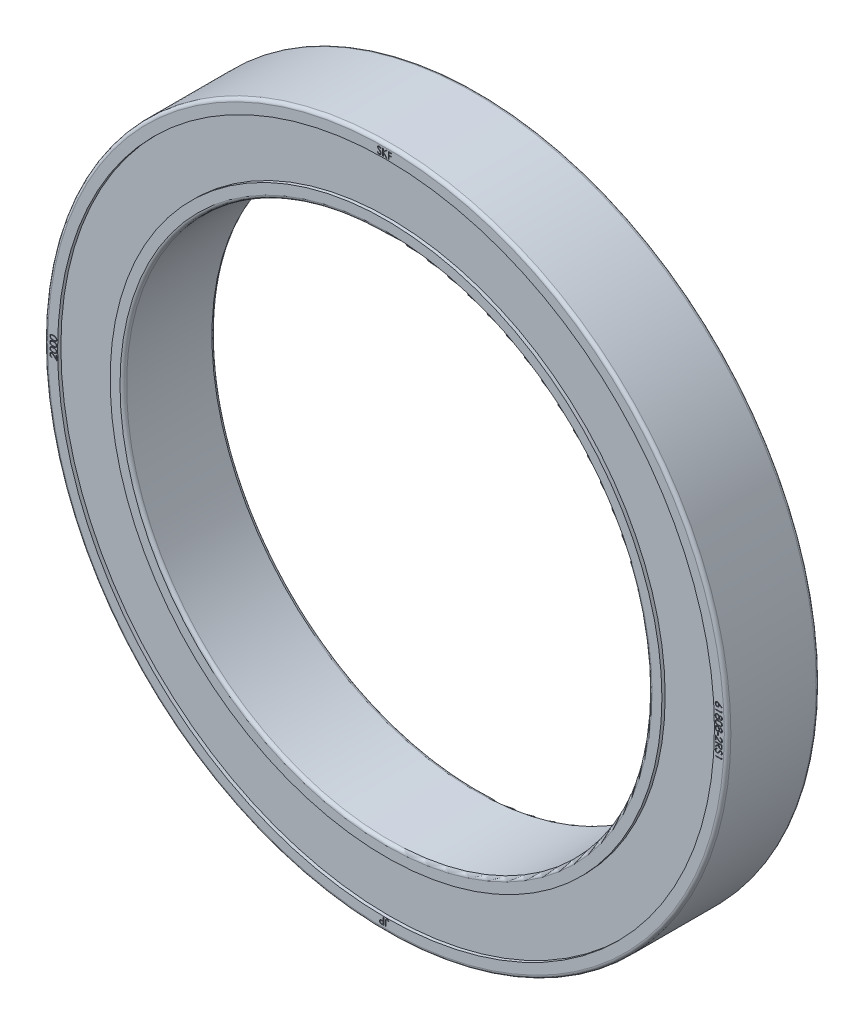
from build123d import *

# Parameters (mm, degrees)
SKETCH1_R           = 26
SKETCH1_R_2         = 20
BOSS_EXTRUDE1_DEPTH = 7
SKETCH2_R           = 25
SKETCH2_R_2         = 21
CUT_EXTRUDE1_DEPTH  = 0.25
CUT_EXTRUDE2_START  = -0.25
SKETCH3_R           = 25
SKETCH3_R_2         = 21
CUT_EXTRUDE2_DEPTH  = 0.25
FILLET1_R           = 0.25
CUT_EXTRUDE3_DEPTH  = 0.1
SKETCH5_W           = 0.053743489
SKETCH5_H           = 0.201538086
CUT_EXTRUDE4_DEPTH  = 0.1
CUT_EXTRUDE5_DEPTH  = 0.1
CUT_EXTRUDE6_DEPTH  = 0.1


with BuildPart() as part:
    # Sketch1 → Boss-Extrude1 (new body)
    with BuildSketch(Plane.XY):
        Circle(SKETCH1_R)
        Circle(SKETCH1_R_2, mode=Mode.SUBTRACT)
    extrude(amount=BOSS_EXTRUDE1_DEPTH)

    # Sketch2 → Cut-Extrude1 (cut)
    with BuildSketch(Plane.XY.offset(7)):
        Circle(SKETCH2_R)
        Circle(SKETCH2_R_2, mode=Mode.SUBTRACT)
    extrude(amount=-CUT_EXTRUDE1_DEPTH, mode=Mode.SUBTRACT)

    # Sketch3 → Cut-Extrude2 (cut)
    with BuildSketch(Plane(origin=(0, 0, 0), x_dir=(-1, 0, 0), z_dir=(0, 0, -1)).offset(CUT_EXTRUDE2_START)):
        with Locations(Location((0, 0, 0), (0, 0, 180))):
            Circle(SKETCH3_R)
        with Locations(Location((0, 0, 0), (0, 0, 180))):
            Circle(SKETCH3_R_2, mode=Mode.SUBTRACT)
    extrude(amount=CUT_EXTRUDE2_DEPTH, mode=Mode.SUBTRACT)

    # Fillet1
    fillet1_edges = [part.edges().sort_by_distance(p)[0] for p in [
        (-26, 0, 0),
        (-26, 0, 7),
        (-20, 0, 0),
        (-20, 0, 7),
    ]]
    fillet(fillet1_edges, radius=FILLET1_R)

    # Sketch4 → Cut-Extrude3 (cut)
    with BuildSketch(Plane.XY.offset(7)):
        with BuildLine():
            Line((-0.672721354, 25.186610114), (-0.628424962, 25.213166956))
            add(Edge.make_bspline(
                [(-0.628424962, 25.213166956), (-0.624305097, 25.206270472), (-0.616411593, 25.193057076), (-0.603244043, 25.175202477), (-0.58960017, 25.160027142), (-0.575378936, 25.147619353), (-0.560667147, 25.137850681), (-0.545368763, 25.130933559), (-0.529535338, 25.126619404), (-0.518759848, 25.126095392), (-0.513380305, 25.125833785)],
                knots=[0, 0, 0, 0, 1.272034388, 2.437168799, 3.508375237, 4.49857839, 5.41946034, 6.295179144, 7.148887113, 8, 8, 8, 8], degree=3))
            add(Edge.make_bspline(
                [(-0.513380305, 25.125833785), (-0.508786052, 25.125961742), (-0.499677935, 25.126215416), (-0.486269213, 25.12865288), (-0.473246819, 25.132397546), (-0.460879149, 25.137760441), (-0.449336855, 25.144248819), (-0.439215186, 25.152085775), (-0.430464984, 25.160859945), (-0.42330729, 25.170648644), (-0.417815775, 25.181176106), (-0.413595028, 25.191981857), (-0.411252741, 25.203235645), (-0.410899902, 25.21081274), (-0.410721842, 25.214636504)],
                knots=[0, 0, 0, 0, 1.095163259, 2.171163733, 3.241058638, 4.321873601, 5.38011039, 6.391990106, 7.366004449, 8.327778327, 9.272591725, 10.192022065, 11.087607919, 12, 12, 12, 12], degree=3))
            add(Edge.make_bspline(
                [(-0.410721842, 25.214636504), (-0.410942567, 25.218999298), (-0.411391269, 25.227868219), (-0.415183746, 25.240953171), (-0.421149737, 25.25390232), (-0.426653619, 25.261912209), (-0.42951107, 25.266070703)],
                knots=[0, 0, 0, 0, 0.938893495, 1.908633276, 2.914225137, 4, 4, 4, 4], degree=3))
            add(Edge.make_bspline(
                [(-0.42951107, 25.266070703), (-0.431857181, 25.269071994), (-0.436782546, 25.275372827), (-0.445249998, 25.284751696), (-0.455185935, 25.294425979), (-0.466250332, 25.304765087), (-0.478846234, 25.315288154), (-0.492579128, 25.326496984), (-0.507799631, 25.337965313), (-0.518474165, 25.345656506), (-0.523982048, 25.349625035)],
                knots=[0, 0, 0, 0, 0.722233717, 1.516239348, 2.393582979, 3.351407094, 4.387010283, 5.505090956, 6.712668013, 8, 8, 8, 8], degree=3))
            add(Edge.make_bspline(
                [(-0.523982048, 25.349625035), (-0.529495116, 25.353551822), (-0.540035682, 25.361059539), (-0.554776311, 25.372201897), (-0.5679578, 25.382389017), (-0.579521563, 25.391716801), (-0.589462513, 25.400186512), (-0.597858985, 25.407716818), (-0.604497088, 25.414511373), (-0.608188374, 25.418919154), (-0.60984567, 25.420898139)],
                knots=[0, 0, 0, 0, 1.452282411, 2.77665338, 3.964542531, 5.026858415, 5.96415736, 6.766646006, 7.446254459, 8, 8, 8, 8], degree=3))
            add(Edge.make_bspline(
                [(-0.60984567, 25.420898139), (-0.612162127, 25.423982403), (-0.61671775, 25.430048021), (-0.622731163, 25.43952864), (-0.627842274, 25.44923359), (-0.63184897, 25.459188953), (-0.635222958, 25.469254963), (-0.637492312, 25.479562959), (-0.638913308, 25.490066687), (-0.639058828, 25.497135209), (-0.639131673, 25.500673631)],
                knots=[0, 0, 0, 0, 1.068054152, 2.10047183, 3.106115577, 4.101338837, 5.06977816, 6.043150881, 7.020423561, 8, 8, 8, 8], degree=3))
            add(Edge.make_bspline(
                [(-0.639131673, 25.500673631), (-0.638936265, 25.506217507), (-0.638549626, 25.517186763), (-0.635279794, 25.533210777), (-0.630118719, 25.548509515), (-0.622888298, 25.562931515), (-0.6135675, 25.576101255), (-0.602781209, 25.588170223), (-0.589934027, 25.598316129), (-0.575838061, 25.607181003), (-0.560409079, 25.614119638), (-0.544241328, 25.619353786), (-0.527309112, 25.622319509), (-0.51584055, 25.622745111), (-0.510021337, 25.622961064)],
                knots=[0, 0, 0, 0, 1.005424448, 1.989358655, 2.955360095, 3.929531133, 4.905563448, 5.876582895, 6.856512386, 7.866279853, 8.892233794, 9.918561126, 10.94386622, 12, 12, 12, 12], degree=3))
            add(Edge.make_bspline(
                [(-0.510021337, 25.622961064), (-0.503846517, 25.622748088), (-0.491566772, 25.622324547), (-0.473503895, 25.618641952), (-0.456113008, 25.612548491), (-0.442123243, 25.605633402), (-0.431174244, 25.598726883), (-0.422824285, 25.592435927), (-0.414362831, 25.585193495), (-0.40572163, 25.576980298), (-0.397047101, 25.567720973), (-0.388210464, 25.557478935), (-0.379191053, 25.546316774), (-0.373388758, 25.538348321), (-0.370414225, 25.534263312)],
                knots=[0, 0, 0, 0, 1.286793592, 2.559021753, 3.825965368, 5.121522368, 5.803751409, 6.523245864, 7.299691795, 8.125521123, 9.008227632, 9.944561021, 10.946284179, 12, 12, 12, 12], degree=3))
            Line((-0.370414225, 25.534263312), (-0.412926165, 25.502038212))
            add(Edge.make_bspline(
                [(-0.412926165, 25.502038212), (-0.415493152, 25.505345199), (-0.420436567, 25.511713681), (-0.427941653, 25.520632341), (-0.435015438, 25.528779251), (-0.441984684, 25.535855502), (-0.448481319, 25.54224861), (-0.45478683, 25.547722117), (-0.460810476, 25.552329655), (-0.468403508, 25.557246796), (-0.477942943, 25.562120961), (-0.489917748, 25.566245444), (-0.502431784, 25.568723968), (-0.510954948, 25.569051675), (-0.515269725, 25.569217574)],
                knots=[0, 0, 0, 0, 1.181633172, 2.275549214, 3.290209073, 4.226197932, 5.078386478, 5.862611352, 6.581680152, 7.217281963, 8.414376989, 9.595101626, 10.782541182, 12, 12, 12, 12], degree=3))
            add(Edge.make_bspline(
                [(-0.515269725, 25.569217574), (-0.520682862, 25.569036166), (-0.531121589, 25.568686337), (-0.545941814, 25.564865637), (-0.559280422, 25.55884985), (-0.570741413, 25.550418709), (-0.580283732, 25.540429642), (-0.587186365, 25.528934772), (-0.591340953, 25.516241659), (-0.591847926, 25.507387324), (-0.59210612, 25.502877954)],
                knots=[0, 0, 0, 0, 1.14458467, 2.207223713, 3.21896685, 4.227309161, 5.202851033, 6.127160689, 7.046193047, 8, 8, 8, 8], degree=3))
            add(Edge.make_bspline(
                [(-0.59210612, 25.502877954), (-0.592047263, 25.500070595), (-0.591929454, 25.494451287), (-0.590286373, 25.486149432), (-0.588175506, 25.47786855), (-0.584830501, 25.46964587), (-0.580212527, 25.461337587), (-0.574148335, 25.452800634), (-0.566510927, 25.443959766), (-0.560660551, 25.438209645), (-0.557571729, 25.435173754)],
                knots=[0, 0, 0, 0, 0.858281714, 1.717966888, 2.583508476, 3.4729293, 4.427298488, 5.488583878, 6.674047936, 8, 8, 8, 8], degree=3))
            add(Edge.make_bspline(
                [(-0.557571729, 25.435173754), (-0.556424714, 25.434150155), (-0.55369967, 25.431718319), (-0.548717798, 25.427737082), (-0.542138945, 25.422826048), (-0.534134905, 25.416749558), (-0.524558095, 25.409700804), (-0.513407462, 25.401769912), (-0.500807302, 25.39269942), (-0.491866094, 25.386357903), (-0.487138367, 25.38300478)],
                knots=[0, 0, 0, 0, 0.420754252, 0.999615792, 1.744751191, 2.668019286, 3.750313428, 4.999500688, 6.413464383, 8, 8, 8, 8], degree=3))
            add(Edge.make_bspline(
                [(-0.487138367, 25.38300478), (-0.481451343, 25.378866482), (-0.470439211, 25.37085324), (-0.454770505, 25.358813886), (-0.440563573, 25.347039213), (-0.427768535, 25.335604416), (-0.416258985, 25.32459623), (-0.406162613, 25.31388222), (-0.397376545, 25.303539142), (-0.387917731, 25.290278587), (-0.378252521, 25.273992535), (-0.369952151, 25.254038916), (-0.364718397, 25.234007733), (-0.364033977, 25.220544426), (-0.363696289, 25.21390173)],
                knots=[0, 0, 0, 0, 1.163667725, 2.253281268, 3.268753668, 4.215851969, 5.092017293, 5.902905408, 6.650798638, 7.335211899, 8.59617414, 9.77448103, 10.901945474, 12, 12, 12, 12], degree=3))
            add(Edge.make_bspline(
                [(-0.363696289, 25.21390173), (-0.363794672, 25.209203949), (-0.363989527, 25.199899615), (-0.366229385, 25.186237452), (-0.369511066, 25.17296817), (-0.374457203, 25.160255787), (-0.380494144, 25.147867737), (-0.388154448, 25.136128976), (-0.397033639, 25.124779696), (-0.407219247, 25.114122531), (-0.418364841, 25.10433929), (-0.430144893, 25.095636555), (-0.442578682, 25.088380168), (-0.455598757, 25.082458853), (-0.46920811, 25.077827672), (-0.483402164, 25.074472152), (-0.498204314, 25.072412729), (-0.508265168, 25.072198973), (-0.513380305, 25.072090296)],
                knots=[0, 0, 0, 0, 0.983748083, 1.948392443, 2.894712957, 3.844097841, 4.80183111, 5.778335162, 6.776009319, 7.81870978, 8.863265674, 9.881300176, 10.883814829, 11.87499822, 12.874611388, 13.892143829, 14.928324115, 16, 16, 16, 16], degree=3))
            add(Edge.make_bspline(
                [(-0.513380305, 25.072090296), (-0.517338046, 25.072166827), (-0.525203685, 25.072318925), (-0.536837883, 25.073663548), (-0.548237046, 25.07556598), (-0.559258135, 25.078586321), (-0.570043144, 25.082250867), (-0.580545168, 25.086762997), (-0.590769295, 25.092170248), (-0.600772823, 25.098352692), (-0.61053031, 25.105547609), (-0.619950235, 25.113927626), (-0.629341673, 25.123261621), (-0.638427426, 25.133803069), (-0.647391275, 25.145381663), (-0.656056483, 25.158105734), (-0.664602416, 25.171905975), (-0.669964493, 25.181617187), (-0.672721354, 25.186610114)],
                knots=[0, 0, 0, 0, 0.915332311, 1.819136955, 2.706846663, 3.586547465, 4.459518054, 5.340707479, 6.227863349, 7.133153174, 8.059268498, 9.028702269, 10.047606654, 11.120612155, 12.245963614, 13.433783089, 14.680604001, 16, 16, 16, 16], degree=3))
        make_face()
        Polygon((-0.25620931, 25.609525191), (-0.209183757, 25.609525191), (-0.209183757, 25.409981493), (0.009254138, 25.609525191), (0.076328532, 25.609525191), (-0.181157366, 25.374397424), (0.09648234, 25.085526168), (0.033816592, 25.085526168), (-0.209183757, 25.338393485), (-0.209183757, 25.085526168), (-0.25620931, 25.085526168), align=None)
        Polygon((0.173738607, 25.609525191), (0.429020182, 25.609525191), (0.429020182, 25.555781702), (0.22076416, 25.555781702), (0.22076416, 25.394551233), (0.429020182, 25.394551233), (0.429020182, 25.340807743), (0.22076416, 25.340807743), (0.22076416, 25.085526168), (0.173738607, 25.085526168), align=None)
    extrude(amount=-CUT_EXTRUDE3_DEPTH, mode=Mode.SUBTRACT)

    # Sketch5 → Cut-Extrude4 (cut)
    # profile 1 of 10: a face of its own
    with BuildSketch(Plane.XY.offset(7)):
        with BuildLine():
            Line((25.606403456, 1.63338623), (25.577957195, 1.597172356))
            Line((25.577957195, 1.597172356), (25.366237237, 1.735624822))
            add(Edge.make_bspline(
                [(25.366237237, 1.735624822), (25.36770651, 1.726406889), (25.370572492, 1.708426269), (25.37104528, 1.690226151), (25.37127569, 1.681356494)],
                knots=[0, 0, 0, 0, 1.025318673, 2, 2, 2, 2], degree=3))
            add(Edge.make_bspline(
                [(25.37127569, 1.681356494), (25.371132546, 1.676030793), (25.370850773, 1.665547309), (25.368682338, 1.650155691), (25.365265099, 1.635365603), (25.360283776, 1.621238348), (25.353920578, 1.607723218), (25.346294316, 1.594742655), (25.337011197, 1.582540663), (25.326641263, 1.570960108), (25.315155656, 1.560446128), (25.302968735, 1.551137501), (25.290093199, 1.543318419), (25.276535568, 1.536974449), (25.26231674, 1.532048128), (25.24745491, 1.528456842), (25.231939827, 1.526333958), (25.221388257, 1.526045685), (25.216028383, 1.525899251)],
                knots=[0, 0, 0, 0, 1.04369286, 2.054478336, 3.041073146, 4.015093852, 4.984733326, 5.965804835, 6.960378782, 7.985147595, 9.009457201, 10.008161701, 10.986880575, 11.956520048, 12.937015923, 13.931873656, 14.949455224, 16, 16, 16, 16], degree=3))
            add(Edge.make_bspline(
                [(25.216028383, 1.525899251), (25.208699794, 1.526172708), (25.194287369, 1.526710489), (25.173208024, 1.530625308), (25.153287364, 1.537381411), (25.134447105, 1.546420267), (25.117235405, 1.558147471), (25.101680644, 1.572044853), (25.088122384, 1.588243782), (25.076491318, 1.606360663), (25.06725045, 1.625968754), (25.060418489, 1.64652848), (25.056336218, 1.667864106), (25.055801763, 1.682353931), (25.055532688, 1.689648946)],
                knots=[0, 0, 0, 0, 1.031881447, 2.029301251, 3.006342947, 3.987068354, 4.962916383, 5.929513747, 6.915671209, 7.928552063, 8.953527267, 9.960179832, 10.973036711, 12, 12, 12, 12], degree=3))
            add(Edge.make_bspline(
                [(25.055532688, 1.689648946), (25.055761481, 1.696699983), (25.056214681, 1.710666853), (25.060251868, 1.731212505), (25.066795401, 1.750954321), (25.075810443, 1.769753532), (25.087196925, 1.787169412), (25.100906732, 1.802745609), (25.116636861, 1.816427931), (25.134435565, 1.827754473), (25.153438265, 1.836985635), (25.173433232, 1.843496507), (25.194018061, 1.847707105), (25.208030395, 1.848141521), (25.215083673, 1.848360189)],
                knots=[0, 0, 0, 0, 1.011913813, 2.004424092, 2.994488568, 3.992479987, 4.990471406, 5.973328987, 6.963763268, 7.974390938, 8.994854117, 9.989689954, 10.988086187, 12, 12, 12, 12], degree=3))
            add(Edge.make_bspline(
                [(25.215083673, 1.848360189), (25.220478087, 1.848170284), (25.231487549, 1.847782708), (25.24820992, 1.845469699), (25.265253447, 1.841227356), (25.279701695, 1.836636215), (25.291667462, 1.832080417), (25.301116513, 1.827856176), (25.311095013, 1.82313296), (25.321414161, 1.817596693), (25.332368796, 1.811727803), (25.343553235, 1.804872274), (25.355375968, 1.797718423), (25.36324736, 1.792477695), (25.367286915, 1.789788183)],
                knots=[0, 0, 0, 0, 1.17367173, 2.395347028, 3.66355231, 4.98980831, 5.690886799, 6.447442954, 7.240630024, 8.091733897, 8.994365608, 9.943299771, 10.944512865, 12, 12, 12, 12], degree=3))
            Line((25.367286915, 1.789788183), (25.606403456, 1.63338623))
        make_face()
        with BuildLine():
            add(Edge.make_bspline(
                [(25.3175322, 1.691223462), (25.317414173, 1.695215049), (25.317182605, 1.703046508), (25.315874706, 1.714521897), (25.313396596, 1.725353283), (25.310191104, 1.735664378), (25.305826603, 1.745347714), (25.300587964, 1.754513749), (25.294359564, 1.763071529), (25.287210849, 1.770870765), (25.279498368, 1.77803239), (25.27118812, 1.784192557), (25.262533996, 1.789512111), (25.25345466, 1.793835767), (25.243955934, 1.797202943), (25.234080883, 1.799638502), (25.223763453, 1.800993982), (25.216766942, 1.801219485), (25.213194253, 1.801334635)],
                knots=[0, 0, 0, 0, 1.129474985, 2.216020618, 3.260639938, 4.268601163, 5.26556745, 6.258792394, 7.250684778, 8.252748164, 9.247500881, 10.223461414, 11.174097059, 12.117127289, 13.062595836, 14.020469732, 14.98917545, 16, 16, 16, 16], degree=3))
            add(Edge.make_bspline(
                [(25.213194253, 1.801334635), (25.209653655, 1.801240619), (25.202711068, 1.801056266), (25.192477813, 1.799390055), (25.182639099, 1.796826732), (25.17318773, 1.793074706), (25.164175263, 1.788368568), (25.155537679, 1.782577146), (25.147269016, 1.775798503), (25.13957778, 1.767918465), (25.132523192, 1.759420608), (25.126241773, 1.750433562), (25.120967062, 1.740985901), (25.116796986, 1.731023717), (25.113381595, 1.720686488), (25.110976492, 1.709895354), (25.109617138, 1.698640834), (25.109391323, 1.691017119), (25.109276178, 1.68712972)],
                knots=[0, 0, 0, 0, 0.989642335, 1.94054129, 2.892446913, 3.828371744, 4.778262963, 5.730973156, 6.732161388, 7.763274768, 8.805796303, 9.818398792, 10.825975928, 11.825728216, 12.834635236, 13.867465554, 14.912602056, 16, 16, 16, 16], degree=3))
            add(Edge.make_bspline(
                [(25.109276178, 1.68712972), (25.109391314, 1.683242315), (25.109617112, 1.675618587), (25.110976594, 1.664364158), (25.113381222, 1.65357269), (25.116798338, 1.643236676), (25.120962048, 1.633270002), (25.126274826, 1.623814071), (25.132485001, 1.614741223), (25.139589922, 1.606248941), (25.147225557, 1.598335967), (25.155612546, 1.591716094), (25.164106613, 1.585741708), (25.173223644, 1.58121632), (25.182633409, 1.577422508), (25.192479337, 1.574872117), (25.202710669, 1.573202459), (25.20965352, 1.57301858), (25.213194253, 1.572924805)],
                knots=[0, 0, 0, 0, 1.087205562, 2.132157158, 3.164804748, 4.173533273, 5.173108684, 6.180507559, 7.20098426, 8.243321352, 9.274252308, 10.269075238, 11.227079059, 12.172305571, 13.108064818, 14.05980203, 15.010532752, 16, 16, 16, 16], degree=3))
            add(Edge.make_bspline(
                [(25.213194253, 1.572924805), (25.216772018, 1.573006231), (25.223794005, 1.573166044), (25.234071587, 1.575008626), (25.244036235, 1.577497339), (25.253463479, 1.581519327), (25.262614021, 1.586309843), (25.271226331, 1.592412646), (25.279544397, 1.599409659), (25.287262, 1.607512879), (25.294321147, 1.616328457), (25.300552027, 1.625703181), (25.305810767, 1.635510565), (25.310198441, 1.645741134), (25.313364816, 1.656511986), (25.315858039, 1.667649263), (25.317184807, 1.679295402), (25.317414927, 1.687196799), (25.3175322, 1.691223462)],
                knots=[0, 0, 0, 0, 0.978265087, 1.920016216, 2.851775529, 3.783928695, 4.718195979, 5.674835085, 6.667117013, 7.690134047, 8.732874136, 9.755756613, 10.767227014, 11.776017537, 12.797239016, 13.836276431, 14.897336092, 16, 16, 16, 16], degree=3))
        make_face(mode=Mode.SUBTRACT)
    # profile 2 of 10: a face of its own
    with BuildSketch(Plane.XY.offset(7)):
        Polygon((25.592967584, 1.360784976), (25.592967584, 1.26389974), (25.068968561, 1.26389974), (25.068968561, 1.310925293), (25.539224094, 1.310925293), (25.539224094, 1.391540527), align=None)
    # profile 3 of 10: a face of its own
    with BuildSketch(Plane.XY.offset(7)):
        with BuildLine():
            add(Edge.make_bspline(
                [(25.360883882, 0.814322853), (25.358644727, 0.810070025), (25.354263966, 0.801749645), (25.347232867, 0.789844759), (25.339887962, 0.77888413), (25.332459815, 0.768711553), (25.324654812, 0.759534516), (25.316562043, 0.751292293), (25.308398286, 0.743726305), (25.299844109, 0.737234324), (25.291075942, 0.731509591), (25.282018415, 0.726568821), (25.272700097, 0.722343884), (25.263016968, 0.718995952), (25.253111878, 0.716237921), (25.242856763, 0.714340214), (25.232319244, 0.713319623), (25.225197602, 0.71312667), (25.221591674, 0.713028971)],
                knots=[0, 0, 0, 0, 1.264385854, 2.473688339, 3.635349404, 4.734491366, 5.785876313, 6.801388178, 7.772322209, 8.711311751, 9.622826105, 10.524996139, 11.423212571, 12.31118177, 13.217849097, 14.126010572, 15.051135535, 16, 16, 16, 16], degree=3))
            add(Edge.make_bspline(
                [(25.221591674, 0.713028971), (25.216546305, 0.713143436), (25.206559626, 0.713370006), (25.191825901, 0.715376136), (25.177482407, 0.718304041), (25.163667814, 0.722863423), (25.150209008, 0.72830932), (25.137352073, 0.735315148), (25.124737496, 0.743177213), (25.116980195, 0.749504957), (25.113055017, 0.752706782)],
                knots=[0, 0, 0, 0, 1.02534174, 2.029536028, 3.018826961, 3.997522084, 4.983122576, 5.966563916, 6.971085759, 8, 8, 8, 8], degree=3))
            add(Edge.make_bspline(
                [(25.113055017, 0.752706782), (25.1084747, 0.756874292), (25.099370668, 0.765157813), (25.087550626, 0.779348145), (25.077617192, 0.794921678), (25.069521872, 0.811818151), (25.063221029, 0.829992399), (25.058693301, 0.849440548), (25.056099891, 0.870200514), (25.055725008, 0.884469078), (25.055532688, 0.891789055)],
                knots=[0, 0, 0, 0, 0.954267603, 1.896743057, 2.838368354, 3.796610408, 4.779680527, 5.799409237, 6.871065594, 8, 8, 8, 8], degree=3))
            add(Edge.make_bspline(
                [(25.055532688, 0.891789055), (25.055705693, 0.898827456), (25.056042344, 0.912523468), (25.058310788, 0.932461299), (25.062326802, 0.951069054), (25.067709877, 0.96843495), (25.074888329, 0.984391083), (25.083687037, 0.998966404), (25.093907261, 1.012374754), (25.105795312, 1.024194719), (25.118530022, 1.03468779), (25.131667577, 1.043905428), (25.145209734, 1.051566895), (25.158954427, 1.05805357), (25.173094341, 1.063019287), (25.187556716, 1.066458549), (25.202316293, 1.068642774), (25.212277013, 1.068933389), (25.217287996, 1.06907959)],
                knots=[0, 0, 0, 0, 1.256882982, 2.445766618, 3.576898315, 4.651879663, 5.686612882, 6.692806257, 7.686348993, 8.689277895, 9.678883454, 10.630458183, 11.551151498, 12.454054546, 13.341321255, 14.221808008, 15.105437234, 16, 16, 16, 16], degree=3))
            add(Edge.make_bspline(
                [(25.217287996, 1.06907959), (25.220964854, 1.068993077), (25.228231622, 1.068822097), (25.238967473, 1.067638571), (25.249417081, 1.06573616), (25.259618153, 1.06315135), (25.269499717, 1.059652452), (25.279096301, 1.055412756), (25.288481638, 1.050517079), (25.297494383, 1.044649073), (25.306434902, 1.038188684), (25.314866503, 1.030525194), (25.323258893, 1.022120143), (25.331248935, 1.012630361), (25.339220661, 1.002346308), (25.346666764, 0.990956282), (25.354132053, 0.97878029), (25.358594657, 0.970125887), (25.360883882, 0.965686353)],
                knots=[0, 0, 0, 0, 0.941717298, 1.86116577, 2.762973304, 3.660719123, 4.553575492, 5.444450535, 6.34648071, 7.261375261, 8.197060099, 9.168336537, 10.175980388, 11.237504102, 12.343496232, 13.506792996, 14.721035322, 16, 16, 16, 16], degree=3))
            add(Edge.make_bspline(
                [(25.360883882, 0.965686353), (25.364197251, 0.97176408), (25.37061286, 0.98353226), (25.382409353, 0.999104386), (25.395138949, 1.01250167), (25.409222365, 1.023204909), (25.424039315, 1.031698017), (25.439542318, 1.037695557), (25.455545741, 1.041612024), (25.466458921, 1.04200865), (25.471939765, 1.042207845)],
                knots=[0, 0, 0, 0, 1.16709546, 2.25982348, 3.287408737, 4.277418348, 5.234967981, 6.16072867, 7.076276605, 8, 8, 8, 8], degree=3))
            add(Edge.make_bspline(
                [(25.471939765, 1.042207845), (25.477523726, 1.041962994), (25.488748461, 1.041470802), (25.505457552, 1.03749098), (25.521868322, 1.031005066), (25.537903498, 1.022184927), (25.553011573, 1.01119336), (25.566607541, 0.998009085), (25.578414255, 0.982857694), (25.588388953, 0.9660082), (25.59654764, 0.947911002), (25.602117076, 0.928783885), (25.605780197, 0.908968655), (25.606193763, 0.895479507), (25.606403456, 0.888640022)],
                knots=[0, 0, 0, 0, 0.888753872, 1.786550278, 2.720173491, 3.693036334, 4.694165094, 5.687489879, 6.699912706, 7.744713188, 8.800178723, 9.852977058, 10.911381959, 12, 12, 12, 12], degree=3))
            add(Edge.make_bspline(
                [(25.606403456, 0.888640022), (25.606187846, 0.881976938), (25.605762687, 0.868838094), (25.602181975, 0.849496355), (25.596268012, 0.830974673), (25.588215419, 0.813374116), (25.578173593, 0.79707925), (25.566247771, 0.782530457), (25.552699575, 0.769768454), (25.537632416, 0.759165155), (25.521597629, 0.750608201), (25.504921156, 0.744514342), (25.487826466, 0.74063815), (25.476263516, 0.740146863), (25.470470216, 0.739900716)],
                knots=[0, 0, 0, 0, 1.072712831, 2.115267497, 3.156282165, 4.197922255, 5.225560591, 6.230883479, 7.219814004, 8.214446311, 9.19021444, 10.138875805, 11.067534608, 12, 12, 12, 12], degree=3))
            add(Edge.make_bspline(
                [(25.470470216, 0.739900716), (25.464784544, 0.740115459), (25.453618207, 0.740537202), (25.437340805, 0.744085855), (25.422094825, 0.750059795), (25.407718165, 0.758224564), (25.394409734, 0.768849514), (25.38221378, 0.781916443), (25.370645483, 0.79701983), (25.364210483, 0.808426253), (25.360883882, 0.814322853)],
                knots=[0, 0, 0, 0, 0.975287281, 1.915408787, 2.843441052, 3.776938647, 4.743139116, 5.754296123, 6.83907365, 8, 8, 8, 8], degree=3))
        make_face()
        with BuildLine():
            add(Edge.make_bspline(
                [(25.552659967, 0.891264216), (25.552562437, 0.894939816), (25.552371626, 0.902130895), (25.551374735, 0.912675054), (25.549435457, 0.922701755), (25.54685458, 0.93231576), (25.543368042, 0.941385257), (25.539266626, 0.95003342), (25.534280241, 0.958113064), (25.528686747, 0.965721725), (25.522534563, 0.972571257), (25.51612475, 0.978650327), (25.509331418, 0.983699898), (25.502323551, 0.987987873), (25.494893158, 0.991099157), (25.487268048, 0.993429352), (25.479351862, 0.995004551), (25.473941721, 0.995122584), (25.47120499, 0.995182292)],
                knots=[0, 0, 0, 0, 1.203892937, 2.355340988, 3.463153438, 4.544400666, 5.610487187, 6.640501085, 7.674077295, 8.714426146, 9.728707835, 10.68524104, 11.601827946, 12.495867327, 13.368432065, 14.231010473, 15.105153427, 16, 16, 16, 16], degree=3))
            add(Edge.make_bspline(
                [(25.47120499, 0.995182292), (25.468469375, 0.995075829), (25.463063407, 0.994865445), (25.455048303, 0.993342672), (25.447274426, 0.990796584), (25.439669202, 0.98730535), (25.432252154, 0.982825005), (25.424994859, 0.977387204), (25.418089231, 0.970756002), (25.411339344, 0.963433154), (25.405120573, 0.955434238), (25.399565627, 0.947028832), (25.395137273, 0.938155594), (25.391254511, 0.929080256), (25.38834199, 0.919610896), (25.386243689, 0.909812806), (25.38494576, 0.899696452), (25.384790246, 0.892842574), (25.384711562, 0.889374797)],
                knots=[0, 0, 0, 0, 0.873213166, 1.72559466, 2.594724523, 3.479581045, 4.391597569, 5.35687048, 6.368548091, 7.443976143, 8.534559525, 9.600545123, 10.654815915, 11.696401765, 12.749428718, 13.812189468, 14.893058657, 16, 16, 16, 16], degree=3))
            add(Edge.make_bspline(
                [(25.384711562, 0.889374797), (25.384842242, 0.884920789), (25.385102313, 0.876056767), (25.387520369, 0.862989828), (25.391323991, 0.850284702), (25.396528045, 0.838077186), (25.403059747, 0.826683263), (25.410879761, 0.816526655), (25.419807521, 0.807693994), (25.429704042, 0.80027707), (25.44023666, 0.794526578), (25.450806513, 0.790049859), (25.461526369, 0.787435671), (25.468707696, 0.787094687), (25.472254668, 0.78692627)],
                knots=[0, 0, 0, 0, 1.076279235, 2.141928126, 3.20205304, 4.278698113, 5.344010996, 6.36967002, 7.368914609, 8.37248503, 9.349703398, 10.264243087, 11.142681841, 12, 12, 12, 12], degree=3))
            add(Edge.make_bspline(
                [(25.472254668, 0.78692627), (25.474744238, 0.787005696), (25.479685677, 0.787163347), (25.486980728, 0.788468895), (25.494118307, 0.790609561), (25.501100144, 0.793562217), (25.508024418, 0.797220034), (25.514598809, 0.80194526), (25.521189197, 0.807309189), (25.527503519, 0.813540306), (25.533449222, 0.820564862), (25.538564055, 0.828493756), (25.543006205, 0.8371253), (25.546575533, 0.846529914), (25.549263795, 0.8566709), (25.551274816, 0.867509525), (25.552408785, 0.879133873), (25.552574424, 0.887133071), (25.552659967, 0.891264216)],
                knots=[0, 0, 0, 0, 0.814272661, 1.61621452, 2.416847352, 3.248328223, 4.093649164, 4.973549185, 5.892801723, 6.872536627, 7.872406081, 8.898230315, 9.953166191, 11.044090313, 12.18293744, 13.382234284, 14.648068262, 16, 16, 16, 16], degree=3))
        make_face(mode=Mode.SUBTRACT)
        with BuildLine():
            add(Edge.make_bspline(
                [(25.330968072, 0.888220151), (25.330885216, 0.892880134), (25.330722671, 0.902021883), (25.328912262, 0.915414602), (25.326394274, 0.928268883), (25.322566131, 0.940536324), (25.317629609, 0.952201886), (25.311589901, 0.963291847), (25.30455725, 0.9738219), (25.296493233, 0.983619509), (25.287759698, 0.992546152), (25.278632208, 1.000515402), (25.269045203, 1.007148907), (25.259084202, 1.012569343), (25.248761614, 1.016768182), (25.238079512, 1.019868557), (25.227005969, 1.021668279), (25.21949863, 1.021924734), (25.215713479, 1.022054036)],
                knots=[0, 0, 0, 0, 1.140506561, 2.237395584, 3.304560074, 4.345354409, 5.3782877, 6.402081073, 7.433555996, 8.474808822, 9.504965884, 10.489266388, 11.437701257, 12.354123303, 13.261162422, 14.161620169, 15.073101032, 16, 16, 16, 16], degree=3))
            add(Edge.make_bspline(
                [(25.215713479, 1.022054036), (25.211007531, 1.021850501), (25.20167104, 1.02144669), (25.187877408, 1.018225974), (25.174486151, 1.013097186), (25.161732891, 1.005767377), (25.149776498, 0.996881101), (25.139234849, 0.986025354), (25.13007037, 0.973624471), (25.122555974, 0.959554751), (25.116528264, 0.944207077), (25.112426888, 0.927541673), (25.109691278, 0.909793824), (25.109416725, 0.897538088), (25.109276178, 0.891264216)],
                knots=[0, 0, 0, 0, 0.898956152, 1.783507998, 2.694187257, 3.631865312, 4.587204618, 5.533364321, 6.51415483, 7.525942309, 8.574485006, 9.65837228, 10.801290154, 12, 12, 12, 12], degree=3))
            add(Edge.make_bspline(
                [(25.109276178, 0.891264216), (25.109370213, 0.886360985), (25.109553423, 0.876807919), (25.111173951, 0.862872233), (25.113736231, 0.849718591), (25.117498614, 0.837353447), (25.122006176, 0.82562862), (25.127901113, 0.814806301), (25.134567799, 0.804598234), (25.142480578, 0.79548362), (25.150942853, 0.787194567), (25.159855162, 0.779934421), (25.16912674, 0.773790003), (25.178752545, 0.768837037), (25.188697105, 0.764903902), (25.199001267, 0.762068561), (25.209705499, 0.76032106), (25.216966436, 0.760144183), (25.220646964, 0.760054525)],
                knots=[0, 0, 0, 0, 1.22469164, 2.386092043, 3.500511288, 4.568136916, 5.611981868, 6.63276519, 7.641422348, 8.65223666, 9.641383647, 10.598487484, 11.519869765, 12.415254456, 13.298392158, 14.187051141, 15.081026348, 16, 16, 16, 16], degree=3))
            add(Edge.make_bspline(
                [(25.220646964, 0.760054525), (25.224222137, 0.760189254), (25.231271754, 0.760454917), (25.241710967, 0.762165068), (25.251837455, 0.765101415), (25.261607641, 0.769380983), (25.271127122, 0.774644291), (25.280325563, 0.78110044), (25.289130017, 0.788825062), (25.297549667, 0.79757445), (25.305337765, 0.807103931), (25.312226609, 0.817234955), (25.318028387, 0.827887694), (25.322746836, 0.839040093), (25.32645787, 0.85066726), (25.329050317, 0.862760677), (25.33068214, 0.875334493), (25.330871685, 0.883876406), (25.330968072, 0.888220151)],
                knots=[0, 0, 0, 0, 0.917481483, 1.809113215, 2.707052678, 3.61610275, 4.54058801, 5.494688304, 6.493986409, 7.541809048, 8.607637092, 9.648666143, 10.681335566, 11.715370464, 12.751897579, 13.808646822, 14.885650252, 16, 16, 16, 16], degree=3))
        make_face(mode=Mode.SUBTRACT)
    # profile 4 of 10: a face of its own
    with BuildSketch(Plane.XY.offset(7)):
        with BuildLine():
            add(Edge.make_bspline(
                [(25.330758137, 0.666003418), (25.339156702, 0.665954309), (25.355471034, 0.665858914), (25.379243319, 0.664797678), (25.401544761, 0.663034745), (25.422376427, 0.660618754), (25.441743696, 0.657678674), (25.459594805, 0.653753844), (25.476012398, 0.649290465), (25.491049935, 0.644117431), (25.504910267, 0.63828058), (25.517848789, 0.631926986), (25.529849076, 0.624807966), (25.541091403, 0.617318229), (25.551450301, 0.609184081), (25.560906152, 0.600491316), (25.569464666, 0.591153706), (25.577227704, 0.581355927), (25.583990299, 0.571036061), (25.590083848, 0.560512233), (25.595085195, 0.549598744), (25.599194698, 0.538395127), (25.602487538, 0.526933964), (25.604767824, 0.515167897), (25.60619695, 0.503094086), (25.606333968, 0.494945029), (25.606403456, 0.490812238)],
                knots=[0, 0, 0, 0, 1.646377244, 3.198111528, 4.663803227, 6.031090796, 7.308794487, 8.502186765, 9.612154809, 10.642545331, 11.617106989, 12.558866172, 13.465886467, 14.35053239, 15.20542558, 16.045215227, 16.865619885, 17.686225247, 18.492864914, 19.282407821, 20.068097601, 20.842842034, 21.620163247, 22.403093475, 23.190129512, 24, 24, 24, 24], degree=3))
            add(Edge.make_bspline(
                [(25.606403456, 0.490812238), (25.606330424, 0.486644877), (25.606185184, 0.478357307), (25.60478926, 0.466104657), (25.602473016, 0.454135069), (25.599191139, 0.442499576), (25.595119565, 0.431102599), (25.590016246, 0.420033283), (25.584075764, 0.409222871), (25.577095517, 0.398843156), (25.569313042, 0.388780187), (25.560515447, 0.379281138), (25.550791565, 0.370345145), (25.540245431, 0.361860058), (25.528674771, 0.354066606), (25.51628083, 0.346644769), (25.502846863, 0.340001654), (25.488597014, 0.333603674), (25.473136998, 0.328081176), (25.456553962, 0.323100753), (25.438652031, 0.319076595), (25.419525132, 0.315724607), (25.399103021, 0.313127833), (25.377429476, 0.31123655), (25.354490237, 0.310237496), (25.33880652, 0.31004935), (25.330758137, 0.309952799)],
                knots=[0, 0, 0, 0, 0.810914788, 1.612654377, 2.396697861, 3.181598691, 3.963628158, 4.749916497, 5.551656086, 6.361998678, 7.18212741, 8.025565596, 8.878627764, 9.750805457, 10.657531673, 11.591944965, 12.560506719, 13.57287815, 14.630710178, 15.753379473, 16.941251878, 18.199788006, 19.531962791, 20.947069417, 22.433333509, 24, 24, 24, 24], degree=3))
            add(Edge.make_bspline(
                [(25.330758137, 0.309952799), (25.322744888, 0.310050471), (25.3071314, 0.310240781), (25.284294962, 0.31122404), (25.262737893, 0.313169981), (25.242400184, 0.315576802), (25.223402588, 0.319005287), (25.20556446, 0.322902869), (25.189039741, 0.327747146), (25.173661259, 0.333194372), (25.159481225, 0.339453522), (25.146163388, 0.34615535), (25.13377956, 0.353531631), (25.122209069, 0.361371561), (25.111571473, 0.369784526), (25.101840482, 0.378758357), (25.093022514, 0.388299886), (25.085133706, 0.398385606), (25.078234714, 0.408928609), (25.072068124, 0.419702937), (25.067064319, 0.430923635), (25.06283951, 0.442341334), (25.059550083, 0.454063766), (25.057297834, 0.466079433), (25.055713868, 0.478348985), (25.055593291, 0.486643435), (25.055532688, 0.490812238)],
                knots=[0, 0, 0, 0, 1.56130642, 3.042141888, 4.451772327, 5.777565838, 7.030558081, 8.211376819, 9.333164717, 10.383253789, 11.387583522, 12.350962576, 13.286244149, 14.193812918, 15.072134482, 15.925989337, 16.770211267, 17.600669898, 18.417446232, 19.22325363, 20.01647746, 20.807971184, 21.593601364, 22.38506573, 23.188331689, 24, 24, 24, 24], degree=3))
            add(Edge.make_bspline(
                [(25.055532688, 0.490812238), (25.055602845, 0.494944861), (25.055741182, 0.503093587), (25.057160649, 0.515169824), (25.059475323, 0.52691754), (25.062618638, 0.538360219), (25.066613604, 0.54952128), (25.071695054, 0.560291388), (25.077588746, 0.57081278), (25.084293922, 0.581037446), (25.09197788, 0.59077051), (25.10047611, 0.600067738), (25.110001763, 0.608694377), (25.120402368, 0.616726578), (25.131589676, 0.624348702), (25.143673889, 0.631397961), (25.156733638, 0.637739162), (25.170670484, 0.643706821), (25.185818539, 0.648967301), (25.202323696, 0.653578937), (25.220277257, 0.65742338), (25.239625924, 0.660515101), (25.260384178, 0.663063915), (25.282588568, 0.664789331), (25.306219937, 0.665859759), (25.322429477, 0.665954658), (25.330758137, 0.666003418)],
                knots=[0, 0, 0, 0, 0.810940842, 1.599017053, 2.38298203, 3.159479784, 3.926441347, 4.70693857, 5.494146311, 6.292334103, 7.104379492, 7.925868426, 8.762126819, 9.623561095, 10.503686106, 11.41783325, 12.366995289, 13.351843594, 14.392337808, 15.512229747, 16.713911458, 17.994391108, 19.357476964, 20.818259213, 22.365182633, 24, 24, 24, 24], degree=3))
        make_face()
        with BuildLine():
            add(Edge.make_bspline(
                [(25.330968072, 0.618977865), (25.323969137, 0.618959982), (25.310385579, 0.618925274), (25.290646796, 0.618018576), (25.272236415, 0.616783401), (25.255131061, 0.61519025), (25.23938863, 0.612824328), (25.224900857, 0.610173369), (25.21174439, 0.606947334), (25.199829025, 0.603130322), (25.188952288, 0.598782935), (25.178831979, 0.594035522), (25.169345397, 0.588938281), (25.160588896, 0.583223735), (25.152475311, 0.577021499), (25.145027957, 0.570321391), (25.138279329, 0.563135194), (25.130271429, 0.553187141), (25.121898447, 0.540118535), (25.114697044, 0.523568125), (25.110142133, 0.506554418), (25.109564495, 0.495003262), (25.109276178, 0.489237722)],
                knots=[0, 0, 0, 0, 1.459116078, 2.831857795, 4.118796693, 5.306371758, 6.412361096, 7.436813035, 8.376339383, 9.234574298, 10.043323891, 10.816788787, 11.564361537, 12.286735248, 12.994408768, 13.691741332, 14.372975427, 15.047457468, 16.352811911, 17.594285292, 18.799233213, 20, 20, 20, 20], degree=3))
            add(Edge.make_bspline(
                [(25.109276178, 0.489237722), (25.109515388, 0.483435155), (25.109993314, 0.471842003), (25.114604317, 0.454904289), (25.121561458, 0.438461159), (25.129787869, 0.425574984), (25.137622153, 0.41577133), (25.144301591, 0.4087472), (25.151780684, 0.402300208), (25.159850163, 0.396185577), (25.168664199, 0.390577429), (25.178180406, 0.3854777), (25.188425213, 0.380824088), (25.195577012, 0.378172795), (25.199233542, 0.376817258)],
                knots=[0, 0, 0, 0, 1.353760809, 2.704726607, 4.075137775, 5.516104923, 6.260822281, 7.007110065, 7.778089737, 8.566572457, 9.372053459, 10.217411131, 11.088608312, 12, 12, 12, 12], degree=3))
            add(Edge.make_bspline(
                [(25.199233542, 0.376817258), (25.203909072, 0.375237511), (25.213402402, 0.372029946), (25.228128818, 0.367896077), (25.243579717, 0.364640486), (25.259662762, 0.361711576), (25.27649656, 0.359712436), (25.294029026, 0.358103338), (25.312273379, 0.357155546), (25.324668949, 0.357038057), (25.330968072, 0.356978353)],
                knots=[0, 0, 0, 0, 0.884706709, 1.796334032, 2.740027952, 3.714592787, 4.726048262, 5.777819803, 6.87074269, 8, 8, 8, 8], degree=3))
            add(Edge.make_bspline(
                [(25.330968072, 0.356978353), (25.337267061, 0.357044201), (25.349590753, 0.357173029), (25.367620325, 0.358019443), (25.384774457, 0.35937956), (25.401068711, 0.361220448), (25.416474085, 0.363747598), (25.431012624, 0.366782454), (25.444680407, 0.370340474), (25.457512684, 0.374421629), (25.469463332, 0.379021034), (25.480558369, 0.384101998), (25.490856615, 0.389524075), (25.50032851, 0.395414367), (25.509016807, 0.401701657), (25.516747226, 0.408552216), (25.523759377, 0.415694225), (25.531763472, 0.425697695), (25.539924637, 0.438793821), (25.547435154, 0.455089539), (25.551748158, 0.472047741), (25.55235625, 0.48351186), (25.552659967, 0.489237722)],
                knots=[0, 0, 0, 0, 1.313668642, 2.570134578, 3.763346207, 4.902004944, 5.98888779, 7.017888835, 7.998425394, 8.933058446, 9.82474457, 10.667209444, 11.476765193, 12.250262638, 12.991704352, 13.7104269, 14.401925311, 15.076585796, 16.378385137, 17.609787933, 18.806186071, 20, 20, 20, 20], degree=3))
            add(Edge.make_bspline(
                [(25.552659967, 0.489237722), (25.552356223, 0.495033483), (25.551748181, 0.506635564), (25.547446463, 0.523766339), (25.539994561, 0.540178139), (25.53171077, 0.553169196), (25.523901072, 0.563160045), (25.517109729, 0.570214979), (25.509639846, 0.576810607), (25.501560611, 0.58301801), (25.492799694, 0.588727055), (25.483314492, 0.593826382), (25.473193242, 0.59857107), (25.462318979, 0.602927791), (25.450385651, 0.606709429), (25.437295584, 0.610089515), (25.422794279, 0.612738866), (25.407007836, 0.615050801), (25.389881454, 0.616813521), (25.371428629, 0.618015406), (25.351655711, 0.618926915), (25.338002067, 0.618960541), (25.330968072, 0.618977865)],
                knots=[0, 0, 0, 0, 1.207964612, 2.418129846, 3.655795183, 4.951004962, 5.620895151, 6.296795572, 6.989224116, 7.696855977, 8.419187164, 9.166715907, 9.940135271, 10.748837255, 11.607021648, 12.548275234, 13.5654991, 14.678641405, 15.874140913, 17.15372626, 18.533675393, 20, 20, 20, 20], degree=3))
        make_face(mode=Mode.SUBTRACT)
    # profile 5 of 10: a face of its own
    with BuildSketch(Plane.XY.offset(7)):
        with BuildLine():
            add(Edge.make_bspline(
                [(25.360883882, 0.008170509), (25.358644727, 0.003917681), (25.354263966, -0.004402699), (25.347232867, -0.016307585), (25.339887962, -0.027268214), (25.332459815, -0.037440791), (25.324654812, -0.046617828), (25.316562043, -0.05486005), (25.308398286, -0.062426038), (25.299844109, -0.06891802), (25.291075942, -0.074642753), (25.282018415, -0.079583523), (25.272700097, -0.08380846), (25.263016968, -0.087156392), (25.253111878, -0.089914423), (25.242856763, -0.09181213), (25.232319244, -0.092832721), (25.225197602, -0.093025674), (25.221591674, -0.093123372)],
                knots=[0, 0, 0, 0, 1.264385854, 2.473688339, 3.635349404, 4.734491366, 5.785876313, 6.801388178, 7.772322209, 8.711311751, 9.622826105, 10.524996139, 11.423212571, 12.31118177, 13.217849097, 14.126010572, 15.051135535, 16, 16, 16, 16], degree=3))
            add(Edge.make_bspline(
                [(25.221591674, -0.093123372), (25.216546305, -0.093008907), (25.206559626, -0.092782338), (25.191825901, -0.090776208), (25.177482407, -0.087848303), (25.163667814, -0.083288921), (25.150209008, -0.077843024), (25.137352073, -0.070837196), (25.124737496, -0.062975131), (25.116980195, -0.056647387), (25.113055017, -0.053445562)],
                knots=[0, 0, 0, 0, 1.02534174, 2.029536028, 3.018826961, 3.997522084, 4.983122576, 5.966563916, 6.971085759, 8, 8, 8, 8], degree=3))
            add(Edge.make_bspline(
                [(25.113055017, -0.053445562), (25.1084747, -0.049278052), (25.099370668, -0.040994531), (25.087550626, -0.026804199), (25.077617192, -0.011230666), (25.069521872, 0.005665808), (25.063221029, 0.023840055), (25.058693301, 0.043288205), (25.056099891, 0.064048171), (25.055725008, 0.078316735), (25.055532688, 0.085636711)],
                knots=[0, 0, 0, 0, 0.954267603, 1.896743057, 2.838368354, 3.796610408, 4.779680527, 5.799409237, 6.871065594, 8, 8, 8, 8], degree=3))
            add(Edge.make_bspline(
                [(25.055532688, 0.085636711), (25.055705693, 0.092675112), (25.056042344, 0.106371125), (25.058310788, 0.126308955), (25.062326802, 0.14491671), (25.067709877, 0.162282606), (25.074888329, 0.178238739), (25.083687037, 0.192814061), (25.093907261, 0.20622241), (25.105795312, 0.218042375), (25.118530022, 0.228535446), (25.131667577, 0.237753085), (25.145209734, 0.245414551), (25.158954427, 0.251901227), (25.173094341, 0.256866944), (25.187556716, 0.260306205), (25.202316293, 0.26249043), (25.212277013, 0.262781045), (25.217287996, 0.262927246)],
                knots=[0, 0, 0, 0, 1.256882982, 2.445766618, 3.576898315, 4.651879663, 5.686612882, 6.692806257, 7.686348993, 8.689277895, 9.678883454, 10.630458183, 11.551151498, 12.454054546, 13.341321255, 14.221808008, 15.105437234, 16, 16, 16, 16], degree=3))
            add(Edge.make_bspline(
                [(25.217287996, 0.262927246), (25.220964854, 0.262840733), (25.228231622, 0.262669754), (25.238967473, 0.261486227), (25.249417081, 0.259583816), (25.259618153, 0.256999006), (25.269499717, 0.253500108), (25.279096301, 0.249260413), (25.288481638, 0.244364735), (25.297494383, 0.238496729), (25.306434902, 0.23203634), (25.314866503, 0.224372851), (25.323258893, 0.215967799), (25.331248935, 0.206478017), (25.339220661, 0.196193964), (25.346666764, 0.184803938), (25.354132053, 0.172627947), (25.358594657, 0.163973543), (25.360883882, 0.159534009)],
                knots=[0, 0, 0, 0, 0.941717298, 1.86116577, 2.762973304, 3.660719123, 4.553575492, 5.444450535, 6.34648071, 7.261375261, 8.197060099, 9.168336537, 10.175980388, 11.237504102, 12.343496232, 13.506792996, 14.721035322, 16, 16, 16, 16], degree=3))
            add(Edge.make_bspline(
                [(25.360883882, 0.159534009), (25.364197251, 0.165611736), (25.37061286, 0.177379916), (25.382409353, 0.192952043), (25.395138949, 0.206349326), (25.409222365, 0.217052565), (25.424039315, 0.225545673), (25.439542318, 0.231543213), (25.455545741, 0.23545968), (25.466458921, 0.235856307), (25.471939765, 0.236055501)],
                knots=[0, 0, 0, 0, 1.16709546, 2.25982348, 3.287408737, 4.277418348, 5.234967981, 6.16072867, 7.076276605, 8, 8, 8, 8], degree=3))
            add(Edge.make_bspline(
                [(25.471939765, 0.236055501), (25.477523726, 0.235810651), (25.488748461, 0.235318458), (25.505457552, 0.231338636), (25.521868322, 0.224852722), (25.537903498, 0.216032583), (25.553011573, 0.205041016), (25.566607541, 0.191856742), (25.578414255, 0.17670535), (25.588388953, 0.159855856), (25.59654764, 0.141758659), (25.602117076, 0.122631541), (25.605780197, 0.102816311), (25.606193763, 0.089327163), (25.606403456, 0.082487679)],
                knots=[0, 0, 0, 0, 0.888753872, 1.786550278, 2.720173491, 3.693036334, 4.694165094, 5.687489879, 6.699912706, 7.744713188, 8.800178723, 9.852977058, 10.911381959, 12, 12, 12, 12], degree=3))
            add(Edge.make_bspline(
                [(25.606403456, 0.082487679), (25.606187846, 0.075824594), (25.605762687, 0.06268575), (25.602181975, 0.043344011), (25.596268012, 0.024822329), (25.588215419, 0.007221772), (25.578173593, -0.009073094), (25.566247771, -0.023621886), (25.552699575, -0.03638389), (25.537632416, -0.046987188), (25.521597629, -0.055544143), (25.504921156, -0.061638002), (25.487826466, -0.065514193), (25.476263516, -0.066005481), (25.470470216, -0.066251628)],
                knots=[0, 0, 0, 0, 1.072712831, 2.115267497, 3.156282165, 4.197922255, 5.225560591, 6.230883479, 7.219814004, 8.214446311, 9.19021444, 10.138875805, 11.067534608, 12, 12, 12, 12], degree=3))
            add(Edge.make_bspline(
                [(25.470470216, -0.066251628), (25.464784544, -0.066036885), (25.453618207, -0.065615142), (25.437340805, -0.062066489), (25.422094825, -0.056092549), (25.407718165, -0.047927779), (25.394409734, -0.037302829), (25.38221378, -0.0242359), (25.370645483, -0.009132514), (25.364210483, 0.00227391), (25.360883882, 0.008170509)],
                knots=[0, 0, 0, 0, 0.975287281, 1.915408787, 2.843441052, 3.776938647, 4.743139116, 5.754296123, 6.83907365, 8, 8, 8, 8], degree=3))
        make_face()
        with BuildLine():
            add(Edge.make_bspline(
                [(25.552659967, 0.085111872), (25.552562437, 0.088787472), (25.552371626, 0.095978552), (25.551374735, 0.10652271), (25.549435457, 0.116549412), (25.54685458, 0.126163416), (25.543368042, 0.135232913), (25.539266626, 0.143881076), (25.534280241, 0.15196072), (25.528686747, 0.159569381), (25.522534563, 0.166418913), (25.51612475, 0.172497983), (25.509331418, 0.177547554), (25.502323551, 0.181835529), (25.494893158, 0.184946814), (25.487268048, 0.187277008), (25.479351862, 0.188852208), (25.473941721, 0.188970241), (25.47120499, 0.189029948)],
                knots=[0, 0, 0, 0, 1.203892937, 2.355340988, 3.463153438, 4.544400666, 5.610487187, 6.640501085, 7.674077295, 8.714426146, 9.728707835, 10.68524104, 11.601827946, 12.495867327, 13.368432065, 14.231010473, 15.105153427, 16, 16, 16, 16], degree=3))
            add(Edge.make_bspline(
                [(25.47120499, 0.189029948), (25.468469375, 0.188923486), (25.463063407, 0.188713101), (25.455048303, 0.187190329), (25.447274426, 0.184644241), (25.439669202, 0.181153007), (25.432252154, 0.176672661), (25.424994859, 0.17123486), (25.418089231, 0.164603658), (25.411339344, 0.15728081), (25.405120573, 0.149281894), (25.399565627, 0.140876489), (25.395137273, 0.13200325), (25.391254511, 0.122927912), (25.38834199, 0.113458552), (25.386243689, 0.103660462), (25.38494576, 0.093544109), (25.384790246, 0.086690231), (25.384711562, 0.083222453)],
                knots=[0, 0, 0, 0, 0.873213166, 1.72559466, 2.594724523, 3.479581045, 4.391597569, 5.35687048, 6.368548091, 7.443976143, 8.534559525, 9.600545123, 10.654815915, 11.696401765, 12.749428718, 13.812189468, 14.893058657, 16, 16, 16, 16], degree=3))
            add(Edge.make_bspline(
                [(25.384711562, 0.083222453), (25.384842242, 0.078768446), (25.385102313, 0.069904423), (25.387520369, 0.056837485), (25.391323991, 0.044132358), (25.396528045, 0.031924842), (25.403059747, 0.02053092), (25.410879761, 0.010374311), (25.419807521, 0.00154165), (25.429704042, -0.005875273), (25.44023666, -0.011625765), (25.450806513, -0.016102485), (25.461526369, -0.018716673), (25.468707696, -0.019057657), (25.472254668, -0.019226074)],
                knots=[0, 0, 0, 0, 1.076279235, 2.141928126, 3.20205304, 4.278698113, 5.344010996, 6.36967002, 7.368914609, 8.37248503, 9.349703398, 10.264243087, 11.142681841, 12, 12, 12, 12], degree=3))
            add(Edge.make_bspline(
                [(25.472254668, -0.019226074), (25.474744238, -0.019146648), (25.479685677, -0.018988997), (25.486980728, -0.017683449), (25.494118307, -0.015542783), (25.501100144, -0.012590126), (25.508024418, -0.00893231), (25.514598809, -0.004207084), (25.521189197, 0.001156846), (25.527503519, 0.007387962), (25.533449222, 0.014412518), (25.538564055, 0.022341412), (25.543006205, 0.030972956), (25.546575533, 0.04037757), (25.549263795, 0.050518557), (25.551274816, 0.061357181), (25.552408785, 0.072981529), (25.552574424, 0.080980727), (25.552659967, 0.085111872)],
                knots=[0, 0, 0, 0, 0.814272661, 1.61621452, 2.416847352, 3.248328223, 4.093649164, 4.973549185, 5.892801723, 6.872536627, 7.872406081, 8.898230315, 9.953166191, 11.044090313, 12.18293744, 13.382234284, 14.648068262, 16, 16, 16, 16], degree=3))
        make_face(mode=Mode.SUBTRACT)
        with BuildLine():
            add(Edge.make_bspline(
                [(25.330968072, 0.082067808), (25.330885216, 0.08672779), (25.330722671, 0.095869539), (25.328912262, 0.109262258), (25.326394274, 0.122116539), (25.322566131, 0.13438398), (25.317629609, 0.146049542), (25.311589901, 0.157139503), (25.30455725, 0.167669556), (25.296493233, 0.177467165), (25.287759698, 0.186393808), (25.278632208, 0.194363058), (25.269045203, 0.200996563), (25.259084202, 0.206417), (25.248761614, 0.210615838), (25.238079512, 0.213716213), (25.227005969, 0.215515936), (25.21949863, 0.21577239), (25.215713479, 0.215901693)],
                knots=[0, 0, 0, 0, 1.140506561, 2.237395584, 3.304560074, 4.345354409, 5.3782877, 6.402081073, 7.433555996, 8.474808822, 9.504965884, 10.489266388, 11.437701257, 12.354123303, 13.261162422, 14.161620169, 15.073101032, 16, 16, 16, 16], degree=3))
            add(Edge.make_bspline(
                [(25.215713479, 0.215901693), (25.211007531, 0.215698157), (25.20167104, 0.215294346), (25.187877408, 0.21207363), (25.174486151, 0.206944842), (25.161732891, 0.199615033), (25.149776498, 0.190728757), (25.139234849, 0.17987301), (25.13007037, 0.167472127), (25.122555974, 0.153402407), (25.116528264, 0.138054733), (25.112426888, 0.121389329), (25.109691278, 0.10364148), (25.109416725, 0.091385744), (25.109276178, 0.085111872)],
                knots=[0, 0, 0, 0, 0.898956152, 1.783507998, 2.694187257, 3.631865312, 4.587204618, 5.533364321, 6.51415483, 7.525942309, 8.574485006, 9.65837228, 10.801290154, 12, 12, 12, 12], degree=3))
            add(Edge.make_bspline(
                [(25.109276178, 0.085111872), (25.109370213, 0.080208641), (25.109553423, 0.070655575), (25.111173951, 0.056719889), (25.113736231, 0.043566247), (25.117498614, 0.031201103), (25.122006176, 0.019476277), (25.127901113, 0.008653957), (25.134567799, -0.001554109), (25.142480578, -0.010668724), (25.150942853, -0.018957776), (25.159855162, -0.026217922), (25.16912674, -0.032362341), (25.178752545, -0.037315307), (25.188697105, -0.041248442), (25.199001267, -0.044083783), (25.209705499, -0.045831283), (25.216966436, -0.046008161), (25.220646964, -0.046097819)],
                knots=[0, 0, 0, 0, 1.22469164, 2.386092043, 3.500511288, 4.568136916, 5.611981868, 6.63276519, 7.641422348, 8.65223666, 9.641383647, 10.598487484, 11.519869765, 12.415254456, 13.298392158, 14.187051141, 15.081026348, 16, 16, 16, 16], degree=3))
            add(Edge.make_bspline(
                [(25.220646964, -0.046097819), (25.224222137, -0.04596309), (25.231271754, -0.045697426), (25.241710967, -0.043987276), (25.251837455, -0.041050929), (25.261607641, -0.036771361), (25.271127122, -0.031508053), (25.280325563, -0.025051903), (25.289130017, -0.017327281), (25.297549667, -0.008577893), (25.305337765, 0.000951587), (25.312226609, 0.011082611), (25.318028387, 0.02173535), (25.322746836, 0.032887749), (25.32645787, 0.044514916), (25.329050317, 0.056608333), (25.33068214, 0.069182149), (25.330871685, 0.077724063), (25.330968072, 0.082067808)],
                knots=[0, 0, 0, 0, 0.917481483, 1.809113215, 2.707052678, 3.61610275, 4.54058801, 5.494688304, 6.493986409, 7.541809048, 8.607637092, 9.648666143, 10.681335566, 11.715370464, 12.751897579, 13.808646822, 14.885650252, 16, 16, 16, 16], degree=3))
        make_face(mode=Mode.SUBTRACT)
    # profile 6 of 10: a face of its own
    with BuildSketch(Plane.XY.offset(7)):
        with Locations((25.270506647, -0.240917969)):
            Rectangle(SKETCH5_W, SKETCH5_H)
    # profile 7 of 10: a face of its own
    with BuildSketch(Plane.XY.offset(7)):
        with BuildLine():
            Line((25.431737115, -0.449173991), (25.431737115, -0.402148438))
            add(Edge.make_bspline(
                [(25.431737115, -0.402148438), (25.437975862, -0.402454873), (25.450228593, -0.403056704), (25.468092618, -0.4058763), (25.485169794, -0.409907055), (25.501313715, -0.415619576), (25.516717235, -0.422674039), (25.531175811, -0.431310744), (25.544832945, -0.441345569), (25.55743006, -0.452760106), (25.568945399, -0.46514593), (25.578994714, -0.478428832), (25.587388258, -0.492472287), (25.594443225, -0.50715449), (25.599732405, -0.522645245), (25.603658613, -0.538796476), (25.606020427, -0.555681186), (25.606274327, -0.567185201), (25.606403456, -0.57303594)],
                knots=[0, 0, 0, 0, 1.100776268, 2.161895295, 3.184016182, 4.190939212, 5.176500551, 6.166955529, 7.155448256, 8.160289653, 9.16017456, 10.133824356, 11.091467644, 12.04088621, 13.000931625, 13.972173743, 14.968683325, 16, 16, 16, 16], degree=3))
            add(Edge.make_bspline(
                [(25.606403456, -0.57303594), (25.606268945, -0.578781675), (25.606004635, -0.590071839), (25.603734816, -0.606549664), (25.600179769, -0.622236293), (25.595191984, -0.637101062), (25.588487128, -0.651025373), (25.580432883, -0.664113827), (25.571117703, -0.676522245), (25.560150581, -0.687691926), (25.548442588, -0.697948545), (25.53594328, -0.70679698), (25.523033548, -0.71437448), (25.509614951, -0.720690567), (25.495561143, -0.725340106), (25.481076732, -0.728870093), (25.466011788, -0.730865394), (25.455815283, -0.731171623), (25.450631311, -0.731327311)],
                knots=[0, 0, 0, 0, 1.111607364, 2.184268762, 3.212621178, 4.221274766, 5.211760367, 6.196651075, 7.1921475, 8.207485113, 9.220403448, 10.201281604, 11.166441695, 12.114753415, 13.065576456, 14.026450734, 14.996634279, 16, 16, 16, 16], degree=3))
            add(Edge.make_bspline(
                [(25.450631311, -0.731327311), (25.443333077, -0.731073806), (25.428864684, -0.730571244), (25.40760307, -0.7262723), (25.387003407, -0.719558149), (25.370424482, -0.711473988), (25.357064978, -0.703318701), (25.346065684, -0.695969613), (25.334222488, -0.687366326), (25.321575047, -0.677383621), (25.308024297, -0.666228), (25.293578423, -0.65379842), (25.278386678, -0.640006244), (25.268010658, -0.630325961), (25.262634065, -0.625309881)],
                knots=[0, 0, 0, 0, 1.184426356, 2.348067706, 3.509069118, 4.696110526, 5.333549288, 6.050745305, 6.844228056, 7.710549037, 8.667450064, 9.695053472, 10.805634456, 12, 12, 12, 12], degree=3))
            Line((25.262634065, -0.625309881), (25.12271205, -0.494205157))
            Line((25.12271205, -0.494205157), (25.12271205, -0.738045247))
            Line((25.12271205, -0.738045247), (25.068968561, -0.738045247))
            Line((25.068968561, -0.738045247), (25.068968561, -0.381994629))
            Line((25.068968561, -0.381994629), (25.285831939, -0.585212199))
            add(Edge.make_bspline(
                [(25.285831939, -0.585212199), (25.290996537, -0.590160281), (25.300916672, -0.599664533), (25.315404155, -0.613101634), (25.328828611, -0.625189724), (25.341249528, -0.635936822), (25.35259649, -0.64535177), (25.362958422, -0.653404446), (25.3722464, -0.66013044), (25.383157528, -0.667258592), (25.396495179, -0.674055758), (25.412712498, -0.680029771), (25.429443876, -0.683646357), (25.440747022, -0.684082416), (25.446432601, -0.684301758)],
                knots=[0, 0, 0, 0, 1.329530082, 2.553755191, 3.672934919, 4.687409497, 5.60679272, 6.413407421, 7.126401618, 7.737995624, 8.834647426, 9.90044882, 10.943907757, 12, 12, 12, 12], degree=3))
            add(Edge.make_bspline(
                [(25.446432601, -0.684301758), (25.450008376, -0.684207556), (25.457055541, -0.684021902), (25.467381001, -0.682352382), (25.477379731, -0.679899526), (25.486928102, -0.676118916), (25.496213915, -0.671576653), (25.50495485, -0.665773577), (25.513448866, -0.659142184), (25.521404709, -0.651450095), (25.528693497, -0.643005609), (25.535149638, -0.634083226), (25.540545234, -0.624643818), (25.5449683, -0.614726723), (25.548437982, -0.604359712), (25.550842175, -0.593522701), (25.552351664, -0.582245641), (25.5525559, -0.574545326), (25.552659967, -0.570621681)],
                knots=[0, 0, 0, 0, 0.991504627, 1.954065223, 2.895985987, 3.842598665, 4.797835564, 5.759220273, 6.74786863, 7.784730864, 8.824135544, 9.839918996, 10.835834653, 11.835434876, 12.84861661, 13.863796685, 14.911511676, 16, 16, 16, 16], degree=3))
            add(Edge.make_bspline(
                [(25.552659967, -0.570621681), (25.552552949, -0.566523866), (25.552342783, -0.558476433), (25.550871734, -0.546661407), (25.548336376, -0.535389132), (25.544860454, -0.524636791), (25.540484241, -0.514394024), (25.534928309, -0.504753446), (25.528409582, -0.495627041), (25.52097859, -0.487031572), (25.512666144, -0.479133685), (25.503514011, -0.472048638), (25.49346266, -0.466005842), (25.482739118, -0.460649176), (25.471058262, -0.456550533), (25.458703143, -0.453047053), (25.445498227, -0.450502033), (25.436400339, -0.449624024), (25.431737115, -0.449173991)],
                knots=[0, 0, 0, 0, 1.031212865, 2.025131798, 2.990757446, 3.934781266, 4.865570067, 5.788494791, 6.729227313, 7.684356718, 8.643577152, 9.610526866, 10.590658432, 11.59095419, 12.621640561, 13.700587263, 14.82141059, 16, 16, 16, 16], degree=3))
        make_face()
    # profile 8 of 10: a face of its own
    with BuildSketch(Plane.XY.offset(7)):
        with BuildLine():
            Line((25.592967584, -0.832096354), (25.592967584, -0.93695914))
            add(Edge.make_bspline(
                [(25.592967584, -0.93695914), (25.592944291, -0.943956941), (25.592899565, -0.957393495), (25.592650177, -0.976642715), (25.591935389, -0.994133368), (25.591320276, -1.009856309), (25.590198628, -1.023811249), (25.589126579, -1.036040981), (25.58772321, -1.046489177), (25.586419887, -1.052813972), (25.585829777, -1.055677668)],
                knots=[0, 0, 0, 0, 1.410062039, 2.707475311, 3.878576406, 4.937260626, 5.877586885, 6.699081471, 7.410979367, 8, 8, 8, 8], degree=3))
            add(Edge.make_bspline(
                [(25.585829777, -1.055677668), (25.584882679, -1.059511406), (25.583008687, -1.067097098), (25.579045755, -1.078017765), (25.57446732, -1.088428647), (25.569048039, -1.098290676), (25.562882435, -1.107604765), (25.555934486, -1.11635697), (25.548168808, -1.124497252), (25.539783703, -1.132088246), (25.530706011, -1.138969237), (25.521067966, -1.144923835), (25.510929851, -1.150022727), (25.500256361, -1.154093326), (25.489137721, -1.157367998), (25.477476846, -1.159677734), (25.465325864, -1.161062708), (25.457038017, -1.161203725), (25.452835634, -1.161275228)],
                knots=[0, 0, 0, 0, 1.02737288, 2.032829108, 3.019628684, 3.985738875, 4.958353778, 5.924249254, 6.890702889, 7.883913451, 8.865824512, 9.85161466, 10.829249435, 11.81541824, 12.821369441, 13.843154991, 14.906364023, 16, 16, 16, 16], degree=3))
            add(Edge.make_bspline(
                [(25.452835634, -1.161275228), (25.445853697, -1.161055304), (25.432230131, -1.160626176), (25.41245888, -1.156624973), (25.394015303, -1.150071307), (25.376925069, -1.141038991), (25.361512309, -1.129542015), (25.348020566, -1.115725264), (25.336626174, -1.099659299), (25.328808617, -1.084632721), (25.323778466, -1.071352731), (25.320221466, -1.060387727), (25.317519581, -1.048417678), (25.315063945, -1.035614314), (25.313190097, -1.021878739), (25.311859309, -1.007238615), (25.311003602, -0.991657324), (25.31087858, -0.980976763), (25.310814264, -0.975482305)],
                knots=[0, 0, 0, 0, 1.260402266, 2.459371274, 3.627181936, 4.786749125, 5.93865593, 7.087644312, 8.261344208, 9.485713728, 10.136162886, 10.825977872, 11.566646758, 12.35154167, 13.181268117, 14.0701832, 15.007234106, 16, 16, 16, 16], degree=3))
            Line((25.310814264, -0.975482305), (25.068968561, -1.167993164))
            Line((25.068968561, -1.167993164), (25.068968561, -1.109841029))
            Line((25.068968561, -1.109841029), (25.310814264, -0.91733017))
            Line((25.310814264, -0.91733017), (25.310814264, -0.879121908))
            Line((25.310814264, -0.879121908), (25.068968561, -0.879121908))
            Line((25.068968561, -0.879121908), (25.068968561, -0.832096354))
            Line((25.068968561, -0.832096354), (25.592967584, -0.832096354))
        make_face()
        with BuildLine():
            Line((25.539224094, -0.879121908), (25.364557753, -0.879121908))
            Line((25.364557753, -0.879121908), (25.363822979, -0.975062434))
            add(Edge.make_bspline(
                [(25.363822979, -0.975062434), (25.363820997, -0.979541883), (25.363817156, -0.988224331), (25.36441508, -1.000785435), (25.365095279, -1.01248111), (25.366135692, -1.023266622), (25.367476548, -1.033146775), (25.369153768, -1.042116683), (25.371107922, -1.050190817), (25.374132064, -1.05960803), (25.378926002, -1.070120576), (25.385888924, -1.081559631), (25.39470343, -1.091267861), (25.404622487, -1.099638238), (25.415752584, -1.10608556), (25.427599697, -1.110778079), (25.440061547, -1.113722896), (25.448620973, -1.114072993), (25.452940601, -1.114249674)],
                knots=[0, 0, 0, 0, 1.14660753, 2.222451964, 3.218720504, 4.145691244, 4.995719623, 5.770487122, 6.480909919, 7.121111896, 8.299844659, 9.430703709, 10.534634535, 11.641396424, 12.741395289, 13.810956493, 14.895269934, 16, 16, 16, 16], degree=3))
            add(Edge.make_bspline(
                [(25.452940601, -1.114249674), (25.457155706, -1.11407245), (25.465508506, -1.113721256), (25.477703227, -1.110772373), (25.489295112, -1.106010358), (25.500063214, -1.099332911), (25.509919185, -1.09126424), (25.518235636, -1.081681494), (25.525200179, -1.071067271), (25.529618261, -1.061139702), (25.532332359, -1.052272418), (25.53423989, -1.044572311), (25.535785365, -1.035838779), (25.536986942, -1.026092752), (25.538068225, -1.015351861), (25.5387693, -1.003586698), (25.53919303, -0.990810846), (25.539213499, -0.981955685), (25.539224094, -0.977371724)],
                knots=[0, 0, 0, 0, 1.100801541, 2.181386982, 3.260112282, 4.364594493, 5.481957178, 6.577424609, 7.668452592, 8.790448866, 9.403819393, 10.091598921, 10.863153553, 11.720938239, 12.658472417, 13.685008818, 14.801622349, 16, 16, 16, 16], degree=3))
            Line((25.539224094, -0.977371724), (25.539224094, -0.879121908))
        make_face(mode=Mode.SUBTRACT)
    # profile 9 of 10: a face of its own
    with BuildSketch(Plane.XY.offset(7)):
        with BuildLine():
            Line((25.170052507, -1.221736654), (25.196609348, -1.266033045))
            add(Edge.make_bspline(
                [(25.196609348, -1.266033045), (25.189712865, -1.270152911), (25.176499468, -1.278046414), (25.158644869, -1.291213965), (25.143469535, -1.304857838), (25.131061746, -1.319079072), (25.121293073, -1.333790861), (25.114375952, -1.349089245), (25.110061797, -1.36492267), (25.109537785, -1.375698159), (25.109276178, -1.381077703)],
                knots=[0, 0, 0, 0, 1.272034388, 2.437168799, 3.508375237, 4.49857839, 5.41946034, 6.295179144, 7.148887113, 8, 8, 8, 8], degree=3))
            add(Edge.make_bspline(
                [(25.109276178, -1.381077703), (25.109404134, -1.385671956), (25.109657808, -1.394780074), (25.112095274, -1.408188789), (25.115839931, -1.42121121), (25.12120286, -1.433578782), (25.127691118, -1.44512143), (25.135528495, -1.455241853), (25.144301171, -1.463996475), (25.154095304, -1.471138094), (25.164592189, -1.47668218), (25.175463126, -1.480694033), (25.186660299, -1.483247337), (25.194251644, -1.483572321), (25.198078897, -1.483736165)],
                knots=[0, 0, 0, 0, 1.095270387, 2.171376115, 3.241375676, 4.322296363, 5.380636668, 6.392615365, 7.366724986, 8.328592944, 9.273498763, 10.190095884, 11.087518669, 12, 12, 12, 12], degree=3))
            add(Edge.make_bspline(
                [(25.198078897, -1.483736165), (25.20244169, -1.48351544), (25.211310612, -1.483066739), (25.224395564, -1.479274261), (25.237344713, -1.473308271), (25.245354602, -1.467804388), (25.249513096, -1.464946938)],
                knots=[0, 0, 0, 0, 0.938893495, 1.908633276, 2.914225137, 4, 4, 4, 4], degree=3))
            add(Edge.make_bspline(
                [(25.249513096, -1.464946938), (25.252520522, -1.462607469), (25.258852769, -1.45768163), (25.268120885, -1.449096028), (25.277914552, -1.439283514), (25.288194002, -1.428195034), (25.298771506, -1.41561017), (25.309867552, -1.401787339), (25.321448794, -1.386654985), (25.329107356, -1.375990386), (25.333067427, -1.37047596)],
                knots=[0, 0, 0, 0, 0.72226686, 1.520759855, 2.393439377, 3.351307446, 4.386958158, 5.510256019, 6.712608938, 8, 8, 8, 8], degree=3))
            add(Edge.make_bspline(
                [(25.333067427, -1.37047596), (25.336995113, -1.364963627), (25.344504549, -1.354424467), (25.355635287, -1.339674331), (25.365876796, -1.326502147), (25.375086416, -1.314840796), (25.383665822, -1.304991971), (25.391155208, -1.296595629), (25.397954497, -1.28996154), (25.402361773, -1.286269826), (25.404340532, -1.284612338)],
                knots=[0, 0, 0, 0, 1.452255772, 2.776602448, 3.96446981, 5.032613149, 5.964194703, 6.766668629, 7.446264616, 8, 8, 8, 8], degree=3))
            add(Edge.make_bspline(
                [(25.404340532, -1.284612338), (25.407424796, -1.282295881), (25.413490414, -1.277740258), (25.422971032, -1.271726844), (25.432675983, -1.266615733), (25.442631345, -1.262609038), (25.452697356, -1.25923505), (25.463005352, -1.256965695), (25.47350908, -1.2555447), (25.480577602, -1.25539918), (25.484116024, -1.255326335)],
                knots=[0, 0, 0, 0, 1.068054152, 2.10047183, 3.106115577, 4.101338837, 5.06977816, 6.043150881, 7.020423561, 8, 8, 8, 8], degree=3))
            add(Edge.make_bspline(
                [(25.484116024, -1.255326335), (25.489660364, -1.25552089), (25.500630538, -1.255905843), (25.516647818, -1.259188042), (25.531986711, -1.264308054), (25.546309347, -1.271713091), (25.559582234, -1.280868459), (25.571602583, -1.291688666), (25.581793755, -1.304535279), (25.590594717, -1.318709091), (25.597543445, -1.3341233), (25.602813018, -1.350246598), (25.605759032, -1.367149685), (25.606186538, -1.378617724), (25.606403456, -1.384436671)],
                knots=[0, 0, 0, 0, 1.005541892, 1.989591032, 2.955705311, 3.932863626, 4.905387107, 5.876519979, 6.856563935, 7.871847665, 8.897921447, 9.918317993, 10.943742853, 12, 12, 12, 12], degree=3))
            add(Edge.make_bspline(
                [(25.606403456, -1.384436671), (25.60619447, -1.390612411), (25.605780025, -1.402859642), (25.602047503, -1.42090857), (25.596018298, -1.438319377), (25.589074116, -1.452334223), (25.582169621, -1.463283875), (25.575878217, -1.47163369), (25.568635919, -1.480095187), (25.560422682, -1.488736375), (25.551163368, -1.497410907), (25.540921327, -1.506247544), (25.529759167, -1.515266955), (25.521790713, -1.52106925), (25.517705705, -1.524043783)],
                knots=[0, 0, 0, 0, 1.286821612, 2.551921131, 3.825787379, 5.12137259, 5.803616487, 6.523126609, 7.299589446, 8.125436757, 9.008162487, 9.944516264, 10.946261234, 12, 12, 12, 12], degree=3))
            Line((25.517705705, -1.524043783), (25.485480605, -1.481531843))
            add(Edge.make_bspline(
                [(25.485480605, -1.481531843), (25.488787591, -1.478964856), (25.495156074, -1.474021441), (25.504074733, -1.466516354), (25.512221646, -1.459442571), (25.519297884, -1.45247332), (25.525691037, -1.4459767), (25.531164397, -1.439671142), (25.535772412, -1.433647648), (25.540687561, -1.426053982), (25.545590785, -1.416489418), (25.549651492, -1.404494968), (25.552179565, -1.391994584), (25.552498073, -1.383503975), (25.552659967, -1.379188283)],
                knots=[0, 0, 0, 0, 1.181667846, 2.275615987, 3.290305621, 4.226321945, 5.078535498, 5.862783384, 6.581873284, 7.217493746, 8.414623899, 9.604724551, 10.782505457, 12, 12, 12, 12], degree=3))
            add(Edge.make_bspline(
                [(25.552659967, -1.379188283), (25.552478558, -1.373775145), (25.552128729, -1.363336419), (25.54830803, -1.348516194), (25.542292243, -1.335177586), (25.533861102, -1.323716594), (25.523872035, -1.314174276), (25.512377165, -1.307271643), (25.499684051, -1.303117055), (25.490829717, -1.302610081), (25.486320347, -1.302351888)],
                knots=[0, 0, 0, 0, 1.14458467, 2.207223713, 3.21896685, 4.227309161, 5.202851033, 6.127160689, 7.046193047, 8, 8, 8, 8], degree=3))
            add(Edge.make_bspline(
                [(25.486320347, -1.302351888), (25.483513704, -1.302413485), (25.477895828, -1.302536778), (25.469574029, -1.304140346), (25.4613261, -1.306414157), (25.453115365, -1.309742019), (25.444748662, -1.3142245), (25.436248578, -1.320319327), (25.427400507, -1.327944206), (25.421651466, -1.333796463), (25.418616146, -1.336886279)],
                knots=[0, 0, 0, 0, 0.858526328, 1.718456515, 2.587092892, 3.476767204, 4.426280253, 5.487868114, 6.673670035, 8, 8, 8, 8], degree=3))
            add(Edge.make_bspline(
                [(25.418616146, -1.336886279), (25.417592548, -1.338033294), (25.415160712, -1.340758338), (25.411179475, -1.34574021), (25.40626844, -1.352319063), (25.400191951, -1.360323103), (25.393143196, -1.369899913), (25.385212305, -1.381050546), (25.376141813, -1.393650706), (25.369800296, -1.402591913), (25.366447173, -1.407319641)],
                knots=[0, 0, 0, 0, 0.420754252, 0.999615792, 1.744751191, 2.668019286, 3.750313428, 4.999500688, 6.413464383, 8, 8, 8, 8], degree=3))
            add(Edge.make_bspline(
                [(25.366447173, -1.407319641), (25.362308874, -1.413006664), (25.354295632, -1.424018797), (25.342256279, -1.439687502), (25.330481606, -1.453894435), (25.319046809, -1.466689473), (25.308038623, -1.478199023), (25.297324613, -1.488295395), (25.286981535, -1.497081463), (25.27372098, -1.506540277), (25.257434928, -1.516205487), (25.237481309, -1.524505857), (25.217450125, -1.529739611), (25.203986818, -1.530424031), (25.197344123, -1.530761719)],
                knots=[0, 0, 0, 0, 1.163667725, 2.253281268, 3.268753668, 4.215851969, 5.092017293, 5.902905408, 6.650798638, 7.335211899, 8.59617414, 9.77448103, 10.901945474, 12, 12, 12, 12], degree=3))
            add(Edge.make_bspline(
                [(25.197344123, -1.530761719), (25.192646379, -1.530663281), (25.183342118, -1.530468318), (25.169679417, -1.528229254), (25.156412137, -1.524944618), (25.143692253, -1.520009551), (25.131349562, -1.513938952), (25.119497759, -1.506440891), (25.108299767, -1.497401984), (25.097522558, -1.487355604), (25.08778764, -1.476190737), (25.079080847, -1.464418454), (25.071793315, -1.451962326), (25.065926833, -1.438882644), (25.061265883, -1.425251762), (25.05791569, -1.411055334), (25.055854822, -1.396253827), (25.055641265, -1.386192885), (25.055532688, -1.381077703)],
                knots=[0, 0, 0, 0, 0.983610584, 1.948120116, 2.894308362, 3.843560551, 4.801159957, 5.773581695, 6.77566113, 7.813174769, 8.857584665, 9.875476876, 10.877851407, 11.875574773, 12.875048225, 13.892438445, 14.928473903, 16, 16, 16, 16], degree=3))
            add(Edge.make_bspline(
                [(25.055532688, -1.381077703), (25.055610096, -1.377120136), (25.055763937, -1.369254845), (25.05709177, -1.357652354), (25.059039054, -1.34626292), (25.062007956, -1.335229551), (25.065694861, -1.324414862), (25.070208943, -1.313915251), (25.075582727, -1.303705209), (25.081825116, -1.293772814), (25.089019249, -1.284024473), (25.097333117, -1.274510164), (25.106709296, -1.265121042), (25.11724394, -1.256029225), (25.128824496, -1.247067126), (25.141548, -1.238401412), (25.155348402, -1.229855623), (25.165059591, -1.224493525), (25.170052507, -1.221736654)],
                knots=[0, 0, 0, 0, 0.915384692, 1.819241058, 2.699029451, 3.586605375, 4.459625921, 5.340865773, 6.228072412, 7.126546901, 8.052715223, 9.028303326, 10.047266019, 11.120332924, 12.245748783, 13.433636234, 14.680528497, 16, 16, 16, 16], degree=3))
        make_face()
    # profile 10 of 10: a face of its own
    with BuildSketch(Plane.XY.offset(7)):
        Polygon((25.592967584, -1.702593931), (25.592967584, -1.799479167), (25.068968561, -1.799479167), (25.068968561, -1.752453613), (25.539224094, -1.752453613), (25.539224094, -1.671838379), align=None)
    extrude(amount=-CUT_EXTRUDE4_DEPTH, mode=Mode.SUBTRACT)

    # Sketch6 → Cut-Extrude5 (cut)
    # profile 1 of 2: a face of its own
    with BuildSketch(Plane.XY.offset(7)):
        with BuildLine():
            Line((0.014872233, -25.593859359), (-0.03215332, -25.593859359))
            Line((-0.03215332, -25.593859359), (-0.03215332, -25.240013064))
            add(Edge.make_bspline(
                [(-0.03215332, -25.240013064), (-0.032106536, -25.233469755), (-0.032016703, -25.220905803), (-0.031517681, -25.20280972), (-0.03060686, -25.186249441), (-0.029237617, -25.171269415), (-0.027606341, -25.157846496), (-0.025535268, -25.145960988), (-0.02307206, -25.135607917), (-0.01934238, -25.123988553), (-0.013262549, -25.11120016), (-0.003930173, -25.097512706), (0.007417717, -25.085408554), (0.020752248, -25.075109725), (0.035786998, -25.066608191), (0.052584194, -25.060667274), (0.070836345, -25.057005542), (0.083503159, -25.056622043), (0.090029144, -25.056424464)],
                knots=[0, 0, 0, 0, 1.23761369, 2.376369303, 3.423688776, 4.373947637, 5.221061685, 5.980504468, 6.65465141, 7.232267317, 8.286152468, 9.319580031, 10.354278202, 11.410653829, 12.495036873, 13.606623453, 14.766924254, 16, 16, 16, 16], degree=3))
            add(Edge.make_bspline(
                [(0.090029144, -25.056424464), (0.095148226, -25.0565839), (0.105378242, -25.05690252), (0.12064766, -25.059565788), (0.135778691, -25.063749527), (0.150996677, -25.069763368), (0.166492517, -25.077906589), (0.182664119, -25.088427349), (0.199484593, -25.101604653), (0.210594685, -25.111635298), (0.216410319, -25.116885889)],
                knots=[0, 0, 0, 0, 0.854547984, 1.707735923, 2.581180402, 3.47327429, 4.435225703, 5.500268456, 6.691502816, 8, 8, 8, 8], degree=3))
            Line((0.216410319, -25.116885889), (0.188698832, -25.157193506))
            add(Edge.make_bspline(
                [(0.188698832, -25.157193506), (0.182292262, -25.152807003), (0.170205209, -25.144531137), (0.15262857, -25.133544727), (0.136761092, -25.124619361), (0.126482645, -25.11990553), (0.121729406, -25.117725631)],
                knots=[0, 0, 0, 0, 1.196638425, 2.257656398, 3.194257951, 4, 4, 4, 4], degree=3))
            add(Edge.make_bspline(
                [(0.121729406, -25.117725631), (0.118849436, -25.116534166), (0.113220782, -25.114205549), (0.104489967, -25.111979341), (0.095932359, -25.110367325), (0.090211372, -25.110233568), (0.08740495, -25.110167953)],
                knots=[0, 0, 0, 0, 1.055403208, 2.062694816, 3.049657822, 4, 4, 4, 4], degree=3))
            add(Edge.make_bspline(
                [(0.08740495, -25.110167953), (0.083784271, -25.110318983), (0.076661553, -25.110616093), (0.066251438, -25.113311039), (0.056327499, -25.117475561), (0.047127664, -25.123442442), (0.038750933, -25.130553256), (0.031712198, -25.139037707), (0.025994041, -25.148582205), (0.022348156, -25.157539856), (0.020154441, -25.165779117), (0.018700467, -25.173317216), (0.017648505, -25.182165201), (0.016514972, -25.192266945), (0.015904395, -25.203691898), (0.015192235, -25.216387437), (0.01493873, -25.230390127), (0.014895075, -25.240153083), (0.014872233, -25.245261451)],
                knots=[0, 0, 0, 0, 0.997338315, 1.961996122, 2.948199042, 3.955162468, 4.975046525, 5.968827587, 6.982064989, 8.034375777, 8.624523585, 9.332616724, 10.150461195, 11.082242492, 12.136676661, 13.306224245, 14.590509051, 16, 16, 16, 16], degree=3))
            Line((0.014872233, -25.245261451), (0.014872233, -25.593859359))
        make_face()
    # profile 2 of 2: a face of its own
    with BuildSketch(Plane.XY.offset(7)):
        with BuildLine():
            Line((-0.166512044, -25.593859359), (-0.269275475, -25.593859359))
            add(Edge.make_bspline(
                [(-0.269275475, -25.593859359), (-0.276343608, -25.59385159), (-0.289886467, -25.593836703), (-0.309306628, -25.593385353), (-0.326944395, -25.592782501), (-0.342761736, -25.591946813), (-0.35680732, -25.590959211), (-0.36901759, -25.589574052), (-0.379488522, -25.58812777), (-0.385762504, -25.586657368), (-0.38862381, -25.585986778)],
                knots=[0, 0, 0, 0, 1.415646017, 2.712440637, 3.8905458, 4.950247383, 5.884950622, 6.709939814, 7.411656543, 8, 8, 8, 8], degree=3))
            add(Edge.make_bspline(
                [(-0.38862381, -25.585986778), (-0.392245898, -25.584995349), (-0.399404723, -25.583035854), (-0.409720508, -25.579111725), (-0.4195336, -25.574456683), (-0.428885049, -25.569159163), (-0.437614653, -25.562968991), (-0.445994966, -25.556243443), (-0.453850243, -25.548710521), (-0.461061869, -25.540380144), (-0.467743753, -25.531525211), (-0.473336968, -25.521919927), (-0.478275998, -25.511897502), (-0.482125028, -25.501213236), (-0.485150514, -25.49000816), (-0.487353979, -25.47825311), (-0.488770193, -25.465973446), (-0.488904574, -25.45758021), (-0.488972982, -25.453307538)],
                knots=[0, 0, 0, 0, 0.999333726, 1.975119402, 2.933498163, 3.889020618, 4.832249799, 5.779334906, 6.747801194, 7.724875447, 8.710438469, 9.696133548, 10.679360639, 11.681339199, 12.714023775, 13.766351759, 14.862936069, 16, 16, 16, 16], degree=3))
            add(Edge.make_bspline(
                [(-0.488972982, -25.453307538), (-0.488909889, -25.448999102), (-0.488786443, -25.440569355), (-0.48730483, -25.428236995), (-0.485309114, -25.416451749), (-0.482240418, -25.40523975), (-0.478221244, -25.39466758), (-0.473506443, -25.384573677), (-0.467819777, -25.375129767), (-0.461285534, -25.366301563), (-0.45401668, -25.35808078), (-0.44604397, -25.350526991), (-0.437399589, -25.343684411), (-0.42811101, -25.337537701), (-0.41808768, -25.3322294), (-0.407481618, -25.327474886), (-0.396200635, -25.323481855), (-0.38839417, -25.321381358), (-0.3844251, -25.320313395)],
                knots=[0, 0, 0, 0, 1.121902311, 2.195077645, 3.232258892, 4.234102512, 5.217864754, 6.176164875, 7.132989551, 8.084763148, 9.034132444, 9.988522005, 10.94243251, 11.903244335, 12.886203696, 13.894208494, 14.929344452, 16, 16, 16, 16], degree=3))
            add(Edge.make_bspline(
                [(-0.3844251, -25.320313395), (-0.381142233, -25.319615802), (-0.373947641, -25.318086985), (-0.36209961, -25.316368639), (-0.348297981, -25.314959407), (-0.332589714, -25.3136443), (-0.314938178, -25.312947458), (-0.295383856, -25.312129252), (-0.27386057, -25.311743185), (-0.25884875, -25.31171878), (-0.251011086, -25.311706039)],
                knots=[0, 0, 0, 0, 0.601372724, 1.317943291, 2.144091499, 3.08771165, 4.142394186, 5.309582461, 6.595334295, 8, 8, 8, 8], degree=3))
            Line((-0.251011086, -25.311706039), (-0.213537598, -25.311706039))
            Line((-0.213537598, -25.311706039), (-0.213537598, -25.069860336))
            Line((-0.213537598, -25.069860336), (-0.166512044, -25.069860336))
            Line((-0.166512044, -25.069860336), (-0.166512044, -25.593859359))
        make_face()
        with BuildLine():
            Line((-0.213537598, -25.54011587), (-0.213537598, -25.365449529))
            Line((-0.213537598, -25.365449529), (-0.305279414, -25.364294883))
            add(Edge.make_bspline(
                [(-0.305279414, -25.364294883), (-0.309758921, -25.36429193), (-0.318406518, -25.364286228), (-0.330931966, -25.364893103), (-0.342524715, -25.365553314), (-0.353201882, -25.366621032), (-0.362914734, -25.367923316), (-0.371686785, -25.369664476), (-0.379588042, -25.371440347), (-0.388689416, -25.374521798), (-0.398883908, -25.379170558), (-0.409948543, -25.38611406), (-0.419402366, -25.394861127), (-0.4275142, -25.404802259), (-0.433926051, -25.415872999), (-0.438572997, -25.427685159), (-0.441409397, -25.440193887), (-0.441765908, -25.448744165), (-0.441947428, -25.453097602)],
                knots=[0, 0, 0, 0, 1.160501667, 2.240324542, 3.248665471, 4.168823117, 5.020172044, 5.786515869, 6.485785279, 7.116517804, 8.272762037, 9.381837012, 10.485674779, 11.594342068, 12.695271952, 13.786226926, 14.872841088, 16, 16, 16, 16], degree=3))
            add(Edge.make_bspline(
                [(-0.441947428, -25.453097602), (-0.44175781, -25.457310001), (-0.441380871, -25.465683727), (-0.438596427, -25.477961986), (-0.433876838, -25.48963986), (-0.427508973, -25.500622855), (-0.419591527, -25.510537565), (-0.410325721, -25.519089692), (-0.399855716, -25.526011637), (-0.390192338, -25.53061951), (-0.381544375, -25.533321669), (-0.374068997, -25.535272491), (-0.365585587, -25.536617932), (-0.35617443, -25.537905266), (-0.345847574, -25.538944424), (-0.334539354, -25.539666049), (-0.322287436, -25.540083948), (-0.313782138, -25.540104972), (-0.309373156, -25.54011587)],
                knots=[0, 0, 0, 0, 1.12039168, 2.227199994, 3.330242575, 4.460839274, 5.593542475, 6.693949254, 7.801736126, 8.92216649, 9.528704869, 10.210659466, 10.975987387, 11.81211542, 12.738540127, 13.736887663, 14.826846554, 16, 16, 16, 16], degree=3))
            Line((-0.309373156, -25.54011587), (-0.213537598, -25.54011587))
        make_face(mode=Mode.SUBTRACT)
    extrude(amount=-CUT_EXTRUDE5_DEPTH, mode=Mode.SUBTRACT)

    # Sketch7 → Cut-Extrude6 (cut)
    # profile 1 of 4: a face of its own
    with BuildSketch(Plane.XY.offset(7)):
        with BuildLine():
            Line((-25.421048382, -0.752314148), (-25.421048382, -0.799339701))
            add(Edge.make_bspline(
                [(-25.421048382, -0.799339701), (-25.427287098, -0.799033214), (-25.439539769, -0.798431281), (-25.457404229, -0.795612422), (-25.47447983, -0.791578995), (-25.490629467, -0.785876171), (-25.505995934, -0.778793759), (-25.520518195, -0.770300479), (-25.53414085, -0.760240618), (-25.546737614, -0.748831403), (-25.558293674, -0.736439778), (-25.568272898, -0.723069428), (-25.576704442, -0.709019513), (-25.583753163, -0.694332659), (-25.589044033, -0.678843164), (-25.59296978, -0.662691589), (-25.59533172, -0.645806972), (-25.595585603, -0.634302945), (-25.595714723, -0.628452199)],
                knots=[0, 0, 0, 0, 1.10065271, 2.161652631, 3.183658789, 4.190468796, 5.17591951, 6.163126047, 7.15150782, 8.156236427, 9.156009102, 10.134482811, 11.092018607, 12.041330605, 13.001268258, 13.972401359, 14.968799086, 16, 16, 16, 16], degree=3))
            add(Edge.make_bspline(
                [(-25.595714723, -0.628452199), (-25.595581303, -0.62270606), (-25.595319138, -0.611415101), (-25.593033877, -0.594942996), (-25.58953192, -0.579224657), (-25.58434257, -0.56443822), (-25.577831071, -0.550431935), (-25.569733169, -0.537379223), (-25.560432029, -0.524964456), (-25.549460878, -0.513796928), (-25.537754633, -0.503538207), (-25.525252462, -0.494695809), (-25.512324832, -0.487080666), (-25.498870759, -0.48084791), (-25.484846431, -0.476123204), (-25.470386304, -0.472622649), (-25.455323497, -0.470621543), (-25.445126699, -0.470316111), (-25.439942578, -0.470160828)],
                knots=[0, 0, 0, 0, 1.111674182, 2.184400057, 3.212814286, 4.223731311, 5.211378316, 6.196328225, 7.191884489, 8.207283132, 9.220262353, 10.201199469, 11.166417575, 12.120932471, 13.06540007, 14.026332106, 14.996573967, 16, 16, 16, 16], degree=3))
            add(Edge.make_bspline(
                [(-25.439942578, -0.470160828), (-25.432644347, -0.470414337), (-25.41817596, -0.470916906), (-25.3969143, -0.475215792), (-25.376314813, -0.481930165), (-25.359735323, -0.49001361), (-25.346377083, -0.498170501), (-25.335373139, -0.505513693), (-25.323527967, -0.514159001), (-25.310793625, -0.524032566), (-25.297336879, -0.535304423), (-25.282883175, -0.547681731), (-25.267699773, -0.561484138), (-25.257322549, -0.571162944), (-25.251945332, -0.576178258)],
                knots=[0, 0, 0, 0, 1.184416499, 2.348048165, 3.509039915, 4.696071444, 5.333504901, 6.05069495, 6.844171097, 7.714965912, 8.667477798, 9.695072654, 10.805644396, 12, 12, 12, 12], degree=3))
            Line((-25.251945332, -0.576178258), (-25.112023317, -0.707282982))
            Line((-25.112023317, -0.707282982), (-25.112023317, -0.463442891))
            Line((-25.112023317, -0.463442891), (-25.058279827, -0.463442891))
            Line((-25.058279827, -0.463442891), (-25.058279827, -0.81949351))
            Line((-25.058279827, -0.81949351), (-25.275143205, -0.61627594))
            add(Edge.make_bspline(
                [(-25.275143205, -0.61627594), (-25.280308085, -0.611328208), (-25.290228762, -0.601824629), (-25.304712538, -0.588382919), (-25.318149301, -0.576310133), (-25.330513664, -0.565528121), (-25.341986483, -0.556270779), (-25.352196186, -0.548055637), (-25.361591406, -0.541473373), (-25.372481695, -0.534329709), (-25.385778143, -0.527410829), (-25.402027156, -0.521465333), (-25.418754291, -0.517840031), (-25.430058003, -0.517405137), (-25.435743867, -0.517186381)],
                knots=[0, 0, 0, 0, 1.329631726, 2.553950428, 3.673215718, 4.687767853, 5.603093632, 6.413772471, 7.123043292, 7.734684054, 8.834405432, 9.900288307, 10.943827018, 12, 12, 12, 12], degree=3))
            add(Edge.make_bspline(
                [(-25.435743867, -0.517186381), (-25.439319247, -0.51728156), (-25.446365634, -0.517469141), (-25.456696763, -0.519124633), (-25.466662448, -0.52162643), (-25.476293343, -0.525211371), (-25.485492618, -0.529943342), (-25.49427147, -0.535703346), (-25.502758602, -0.54234916), (-25.510716396, -0.550037165), (-25.518004654, -0.558482759), (-25.524460933, -0.567404853), (-25.529856493, -0.576844337), (-25.534279568, -0.586761411), (-25.537749248, -0.597128428), (-25.540153442, -0.607965438), (-25.541662931, -0.619242498), (-25.541867167, -0.626942813), (-25.541971234, -0.630866458)],
                knots=[0, 0, 0, 0, 0.991446411, 1.95395049, 2.89581595, 3.838931463, 4.798493298, 5.75982156, 6.748411868, 7.785213223, 8.824556874, 9.840280684, 10.836137867, 11.835679398, 12.848801643, 13.863922112, 14.911575587, 16, 16, 16, 16], degree=3))
            add(Edge.make_bspline(
                [(-25.541971234, -0.630866458), (-25.541868407, -0.634965283), (-25.541666473, -0.6430147), (-25.540136925, -0.65480794), (-25.53781813, -0.666135862), (-25.534135377, -0.676829442), (-25.529784021, -0.687120244), (-25.524256092, -0.696788575), (-25.517832515, -0.705994958), (-25.510384117, -0.714587968), (-25.502015302, -0.72243612), (-25.492792291, -0.729428711), (-25.482781482, -0.735498278), (-25.47202396, -0.740801316), (-25.460412622, -0.745105946), (-25.447991322, -0.748395776), (-25.434813253, -0.750998791), (-25.425712879, -0.751868413), (-25.421048382, -0.752314148)],
                knots=[0, 0, 0, 0, 1.030878251, 2.024474673, 2.987898669, 3.934362936, 4.864849709, 5.795128259, 6.730474222, 7.685293701, 8.650606017, 9.611896181, 10.591709709, 11.591680886, 12.625074257, 13.701333388, 14.821793024, 16, 16, 16, 16], degree=3))
        make_face()
    # profile 2 of 4: a face of its own
    with BuildSketch(Plane.XY.offset(7)):
        with BuildLine():
            add(Edge.make_bspline(
                [(-25.320069404, -0.416417338), (-25.328467968, -0.416368229), (-25.344782301, -0.416272834), (-25.368554586, -0.415211598), (-25.390856028, -0.413448665), (-25.411687694, -0.411032674), (-25.431054962, -0.408092594), (-25.448906074, -0.404167767), (-25.465323657, -0.399704377), (-25.480361225, -0.394531379), (-25.494221451, -0.388694405), (-25.507160348, -0.382341246), (-25.519159309, -0.375220681), (-25.530406373, -0.367736467), (-25.540729765, -0.359597244), (-25.55024843, -0.350977532), (-25.558882096, -0.341704936), (-25.566636674, -0.331869391), (-25.573436307, -0.321537559), (-25.579462543, -0.310991768), (-25.584426321, -0.300043589), (-25.588486828, -0.28883715), (-25.591801513, -0.27734883), (-25.594078363, -0.265581563), (-25.595508405, -0.253508071), (-25.595645298, -0.245358971), (-25.595714723, -0.241226158)],
                knots=[0, 0, 0, 0, 1.646148282, 3.197666765, 4.66315463, 6.030252048, 7.307778049, 8.501004361, 9.610818041, 10.641065266, 11.615491391, 12.557119604, 13.464013759, 14.348536654, 15.203310953, 16.038349431, 16.863300206, 17.683791446, 18.490318933, 19.285717724, 20.06220424, 20.843281102, 21.620494212, 22.403315558, 23.190242141, 24, 24, 24, 24], degree=3))
            add(Edge.make_bspline(
                [(-25.595714723, -0.241226158), (-25.595656896, -0.237056776), (-25.595541841, -0.228761173), (-25.593922367, -0.216540745), (-25.591832064, -0.204533176), (-25.588479564, -0.192920645), (-25.584467862, -0.18148358), (-25.579174486, -0.170506399), (-25.573417527, -0.15960155), (-25.566394523, -0.149264424), (-25.558632947, -0.139186168), (-25.549821574, -0.129738855), (-25.54020426, -0.120680987), (-25.52956651, -0.112354676), (-25.518071433, -0.104403067), (-25.505622667, -0.097128012), (-25.4922478, -0.090378203), (-25.478008836, -0.084026762), (-25.46252543, -0.078472594), (-25.445894157, -0.073534494), (-25.427964411, -0.069486886), (-25.408836074, -0.066139586), (-25.388414383, -0.063541443), (-25.366740715, -0.061650559), (-25.343801511, -0.060651391), (-25.328117789, -0.060463262), (-25.320069404, -0.06036672)],
                knots=[0, 0, 0, 0, 0.810910589, 1.61342667, 2.396193133, 3.181089899, 3.963115317, 4.752255436, 5.550715454, 6.36105385, 7.181178335, 8.024612154, 8.872680183, 9.750181803, 10.651284446, 11.591556747, 12.554036451, 13.566402641, 14.62422919, 15.753422176, 16.94128843, 18.199818041, 19.531985927, 20.947085226, 22.433341622, 24, 24, 24, 24], degree=3))
            add(Edge.make_bspline(
                [(-25.320069404, -0.06036672), (-25.312056195, -0.060465386), (-25.296407835, -0.060658063), (-25.273570771, -0.06162913), (-25.252013929, -0.063587629), (-25.231714327, -0.066001726), (-25.212662552, -0.069386439), (-25.19487102, -0.073464738), (-25.17827674, -0.078111353), (-25.162998607, -0.083750763), (-25.148784352, -0.08995437), (-25.13550783, -0.096696935), (-25.123062351, -0.103930936), (-25.111536954, -0.111763289), (-25.100941903, -0.12022656), (-25.091291603, -0.129278079), (-25.082424186, -0.138807878), (-25.074577101, -0.148944889), (-25.067500626, -0.159378298), (-25.061534752, -0.170284256), (-25.056365671, -0.181383648), (-25.052139471, -0.192787293), (-25.048862003, -0.204477582), (-25.046608923, -0.216493381), (-25.04502518, -0.228762898), (-25.044904573, -0.237057353), (-25.044843955, -0.241226158)],
                knots=[0, 0, 0, 0, 1.561645053, 3.049612875, 4.452756685, 5.778837748, 7.032101753, 8.221335837, 9.334924186, 10.387562255, 11.392109817, 12.355697819, 13.287721948, 14.19548756, 15.068665045, 15.927346723, 16.771751757, 17.602390507, 18.423119567, 19.225778204, 20.022010933, 20.807278863, 21.593079439, 22.384715467, 23.188155646, 24, 24, 24, 24], degree=3))
            add(Edge.make_bspline(
                [(-25.044843955, -0.241226158), (-25.044913775, -0.245358881), (-25.045051446, -0.253507803), (-25.046475785, -0.265582601), (-25.048765736, -0.277302579), (-25.051972101, -0.288725571), (-25.055896831, -0.299910181), (-25.061010111, -0.310704012), (-25.066898989, -0.321227037), (-25.073605426, -0.331451337), (-25.081289251, -0.341184197), (-25.089786705, -0.350482642), (-25.099315692, -0.359104479), (-25.109726187, -0.367173128), (-25.120989984, -0.374736464), (-25.133114644, -0.381795498), (-25.146120868, -0.388281887), (-25.160090633, -0.394218585), (-25.175234931, -0.39948213), (-25.191694364, -0.404113535), (-25.209636111, -0.407812497), (-25.228969079, -0.410947938), (-25.24973255, -0.413460409), (-25.271934037, -0.415210866), (-25.29553138, -0.416272029), (-25.311740804, -0.416368018), (-25.320069404, -0.416417338)],
                knots=[0, 0, 0, 0, 0.810927267, 1.598990287, 2.382942141, 3.152806972, 3.926217614, 4.706701772, 5.493896336, 6.292070767, 7.104102563, 7.925577746, 8.761822141, 9.623241997, 10.509042271, 11.423174113, 12.375371989, 13.360203808, 14.400680605, 15.520553799, 16.714061498, 17.994519714, 19.364400916, 20.818312473, 22.365209998, 24, 24, 24, 24], degree=3))
        make_face()
        with BuildLine():
            add(Edge.make_bspline(
                [(-25.320279339, -0.369391785), (-25.313280432, -0.36937351), (-25.299696928, -0.369338041), (-25.279992645, -0.368438274), (-25.261583581, -0.36718589), (-25.244476921, -0.365610318), (-25.228732453, -0.363250675), (-25.214284722, -0.360573517), (-25.201160468, -0.357362428), (-25.189245003, -0.3535444), (-25.178369599, -0.349195295), (-25.168244387, -0.344455173), (-25.158749364, -0.339317811), (-25.149907567, -0.333677904), (-25.141827078, -0.327423948), (-25.134303074, -0.320845875), (-25.127597233, -0.313647349), (-25.119553285, -0.30369125), (-25.111241428, -0.290546679), (-25.1040033, -0.27398531), (-25.099454631, -0.256967535), (-25.098876172, -0.245416915), (-25.098587445, -0.239651642)],
                knots=[0, 0, 0, 0, 1.459098681, 2.831824031, 4.11146945, 5.306290378, 6.412266529, 7.42953815, 8.369053297, 9.227277979, 10.03601793, 10.809473603, 11.557037441, 12.285528272, 12.993193355, 13.685654407, 14.36688038, 15.041354379, 16.352855396, 17.594313975, 18.799247529, 20, 20, 20, 20], degree=3))
            add(Edge.make_bspline(
                [(-25.098587445, -0.239651642), (-25.09884026, -0.233852996), (-25.099344993, -0.222276273), (-25.103750108, -0.205274131), (-25.110911426, -0.188904927), (-25.119093063, -0.175986526), (-25.126934587, -0.166185708), (-25.133612533, -0.159160993), (-25.141092041, -0.152714163), (-25.149161405, -0.146599488), (-25.157975472, -0.140991352), (-25.167491671, -0.135891619), (-25.17773648, -0.131238008), (-25.184888279, -0.128586716), (-25.188544809, -0.127231178)],
                knots=[0, 0, 0, 0, 1.353621445, 2.702441307, 4.075953605, 5.516772412, 6.261413105, 7.007624062, 7.778524365, 8.566925914, 9.372323995, 10.217594641, 11.088702136, 12, 12, 12, 12], degree=3))
            add(Edge.make_bspline(
                [(-25.188544809, -0.127231178), (-25.193220338, -0.125651431), (-25.202713668, -0.122443866), (-25.217440085, -0.118309997), (-25.232890984, -0.115054406), (-25.248974029, -0.112125496), (-25.265807827, -0.110126356), (-25.283340293, -0.108517258), (-25.301584645, -0.107569466), (-25.313980215, -0.107451978), (-25.320279339, -0.107392273)],
                knots=[0, 0, 0, 0, 0.884706709, 1.796334032, 2.740027952, 3.714592787, 4.726048262, 5.777819803, 6.87074269, 8, 8, 8, 8], degree=3))
            add(Edge.make_bspline(
                [(-25.320279339, -0.107392273), (-25.326577444, -0.107474644), (-25.338897883, -0.107635779), (-25.356941143, -0.108251701), (-25.37407857, -0.109842199), (-25.390383993, -0.111608692), (-25.405767153, -0.1142133), (-25.420356828, -0.117021607), (-25.433972276, -0.120794577), (-25.446826644, -0.124824859), (-25.45877397, -0.129437557), (-25.469869666, -0.134515389), (-25.48016832, -0.139937694), (-25.489638111, -0.145829874), (-25.49833397, -0.152109855), (-25.506055804, -0.159002804), (-25.513179239, -0.166070966), (-25.521165136, -0.176123382), (-25.529371963, -0.18917675), (-25.536718937, -0.205531592), (-25.541067074, -0.222458148), (-25.541670064, -0.23392461), (-25.541971234, -0.239651642)],
                knots=[0, 0, 0, 0, 1.313483664, 2.569454835, 3.763100662, 4.901599063, 5.988328865, 7.015709358, 7.99797933, 8.932480776, 9.824041341, 10.666387587, 11.475829342, 12.24921787, 12.990555181, 13.709176526, 14.405678811, 15.080244297, 16.38186033, 17.610124501, 18.806354173, 20, 20, 20, 20], degree=3))
            add(Edge.make_bspline(
                [(-25.541971234, -0.239651642), (-25.541669315, -0.24544804), (-25.541064928, -0.257051396), (-25.536739046, -0.274158712), (-25.529393459, -0.29062404), (-25.521180947, -0.303720454), (-25.513209858, -0.31365075), (-25.506425543, -0.320697521), (-25.499081247, -0.327366823), (-25.490929074, -0.333458834), (-25.482118432, -0.339065298), (-25.472746196, -0.3444012), (-25.462602065, -0.349077934), (-25.451735188, -0.353441002), (-25.439819068, -0.357265398), (-25.426647327, -0.360439796), (-25.412165093, -0.363329711), (-25.396305587, -0.36541092), (-25.379195276, -0.367243563), (-25.360739134, -0.368424525), (-25.340967188, -0.369342163), (-25.327313405, -0.369374913), (-25.320279339, -0.369391785)],
                knots=[0, 0, 0, 0, 1.207546505, 2.417292871, 3.651582144, 4.952510111, 5.626719005, 6.30238548, 6.989136872, 7.692112372, 8.420316868, 9.164734959, 9.937886623, 10.746308695, 11.604196049, 12.543341915, 13.568754172, 14.680483261, 15.875568977, 17.154711427, 18.534182925, 20, 20, 20, 20], degree=3))
        make_face(mode=Mode.SUBTRACT)
    # profile 3 of 4: a face of its own
    with BuildSketch(Plane.XY.offset(7)):
        with BuildLine():
            add(Edge.make_bspline(
                [(-25.320069404, -0.013341166), (-25.328467968, -0.013292057), (-25.344782301, -0.013196662), (-25.368554586, -0.012135427), (-25.390856028, -0.010372493), (-25.411687694, -0.007956502), (-25.431054962, -0.005016422), (-25.448906074, -0.001091595), (-25.465323657, 0.003371795), (-25.480361225, 0.008544793), (-25.494221451, 0.014381767), (-25.507160348, 0.020734926), (-25.519159309, 0.027855491), (-25.530406373, 0.035339705), (-25.540729765, 0.043478928), (-25.55024843, 0.05209864), (-25.558882096, 0.061371236), (-25.566636674, 0.071206781), (-25.573436307, 0.081538613), (-25.579462543, 0.092084404), (-25.584426321, 0.103032582), (-25.588486828, 0.114239022), (-25.591801513, 0.125727342), (-25.594078363, 0.137494609), (-25.595508405, 0.1495681), (-25.595645298, 0.157717201), (-25.595714723, 0.161850014)],
                knots=[0, 0, 0, 0, 1.646148282, 3.197666765, 4.66315463, 6.030252048, 7.307778049, 8.501004361, 9.610818041, 10.641065266, 11.615491391, 12.557119604, 13.464013759, 14.348536654, 15.203310953, 16.038349431, 16.863300206, 17.683791446, 18.490318933, 19.285717724, 20.06220424, 20.843281102, 21.620494212, 22.403315558, 23.190242141, 24, 24, 24, 24], degree=3))
            add(Edge.make_bspline(
                [(-25.595714723, 0.161850014), (-25.595656896, 0.166019396), (-25.595541841, 0.174314999), (-25.593922367, 0.186535427), (-25.591832064, 0.198542996), (-25.588479564, 0.210155527), (-25.584467862, 0.221592592), (-25.579174486, 0.232569772), (-25.573417527, 0.243474622), (-25.566394523, 0.253811748), (-25.558632947, 0.263890004), (-25.549821574, 0.273337317), (-25.54020426, 0.282395185), (-25.52956651, 0.290721496), (-25.518071433, 0.298673105), (-25.505622667, 0.30594816), (-25.4922478, 0.312697969), (-25.478008836, 0.31904941), (-25.46252543, 0.324603578), (-25.445894157, 0.329541678), (-25.427964411, 0.333589285), (-25.408836074, 0.336936586), (-25.388414383, 0.339534728), (-25.366740715, 0.341425613), (-25.343801511, 0.34242478), (-25.328117789, 0.34261291), (-25.320069404, 0.342709452)],
                knots=[0, 0, 0, 0, 0.810910589, 1.61342667, 2.396193133, 3.181089899, 3.963115317, 4.752255436, 5.550715454, 6.36105385, 7.181178335, 8.024612154, 8.872680183, 9.750181803, 10.651284446, 11.591556747, 12.554036451, 13.566402641, 14.62422919, 15.753422176, 16.94128843, 18.199818041, 19.531985927, 20.947085226, 22.433341622, 24, 24, 24, 24], degree=3))
            add(Edge.make_bspline(
                [(-25.320069404, 0.342709452), (-25.312056195, 0.342610786), (-25.296407835, 0.342418109), (-25.273570771, 0.341447042), (-25.252013929, 0.339488543), (-25.231714327, 0.337074446), (-25.212662552, 0.333689733), (-25.19487102, 0.329611434), (-25.17827674, 0.324964818), (-25.162998607, 0.319325409), (-25.148784352, 0.313121802), (-25.13550783, 0.306379236), (-25.123062351, 0.299145236), (-25.111536954, 0.291312883), (-25.100941903, 0.282849612), (-25.091291603, 0.273798093), (-25.082424186, 0.264268294), (-25.074577101, 0.254131283), (-25.067500626, 0.243697873), (-25.061534752, 0.232791916), (-25.056365671, 0.221692523), (-25.052139471, 0.210288879), (-25.048862003, 0.198598589), (-25.046608923, 0.18658279), (-25.04502518, 0.174313274), (-25.044904573, 0.166018819), (-25.044843955, 0.161850014)],
                knots=[0, 0, 0, 0, 1.561645053, 3.049612875, 4.452756685, 5.778837748, 7.032101753, 8.221335837, 9.334924186, 10.387562255, 11.392109817, 12.355697819, 13.287721948, 14.19548756, 15.068665045, 15.927346723, 16.771751757, 17.602390507, 18.423119567, 19.225778204, 20.022010933, 20.807278863, 21.593079439, 22.384715467, 23.188155646, 24, 24, 24, 24], degree=3))
            add(Edge.make_bspline(
                [(-25.044843955, 0.161850014), (-25.044913775, 0.157717291), (-25.045051446, 0.149568369), (-25.046475785, 0.137493571), (-25.048765736, 0.125773593), (-25.051972101, 0.114350601), (-25.055896831, 0.103165991), (-25.061010111, 0.09237216), (-25.066898989, 0.081849135), (-25.073605426, 0.071624835), (-25.081289251, 0.061891975), (-25.089786705, 0.05259353), (-25.099315692, 0.043971693), (-25.109726187, 0.035903044), (-25.120989984, 0.028339708), (-25.133114644, 0.021280674), (-25.146120868, 0.014794285), (-25.160090633, 0.008857587), (-25.175234931, 0.003594042), (-25.191694364, -0.001037363), (-25.209636111, -0.004736325), (-25.228969079, -0.007871766), (-25.24973255, -0.010384237), (-25.271934037, -0.012134694), (-25.29553138, -0.013195857), (-25.311740804, -0.013291846), (-25.320069404, -0.013341166)],
                knots=[0, 0, 0, 0, 0.810927267, 1.598990287, 2.382942141, 3.152806972, 3.926217614, 4.706701772, 5.493896336, 6.292070767, 7.104102563, 7.925577746, 8.761822141, 9.623241997, 10.509042271, 11.423174113, 12.375371989, 13.360203808, 14.400680605, 15.520553799, 16.714061498, 17.994519714, 19.364400916, 20.818312473, 22.365209998, 24, 24, 24, 24], degree=3))
        make_face()
        with BuildLine():
            add(Edge.make_bspline(
                [(-25.320279339, 0.033684387), (-25.313280432, 0.033702662), (-25.299696928, 0.033738131), (-25.279992645, 0.034637898), (-25.261583581, 0.035890282), (-25.244476921, 0.037465854), (-25.228732453, 0.039825496), (-25.214284722, 0.042502655), (-25.201160468, 0.045713744), (-25.189245003, 0.049531772), (-25.178369599, 0.053880877), (-25.168244387, 0.058620999), (-25.158749364, 0.063758361), (-25.149907567, 0.069398267), (-25.141827078, 0.075652224), (-25.134303074, 0.082230296), (-25.127597233, 0.089428823), (-25.119553285, 0.099384922), (-25.111241428, 0.112529493), (-25.1040033, 0.129090861), (-25.099454631, 0.146108637), (-25.098876172, 0.157659257), (-25.098587445, 0.16342453)],
                knots=[0, 0, 0, 0, 1.459098681, 2.831824031, 4.11146945, 5.306290378, 6.412266529, 7.42953815, 8.369053297, 9.227277979, 10.03601793, 10.809473603, 11.557037441, 12.285528272, 12.993193355, 13.685654407, 14.36688038, 15.041354379, 16.352855396, 17.594313975, 18.799247529, 20, 20, 20, 20], degree=3))
            add(Edge.make_bspline(
                [(-25.098587445, 0.16342453), (-25.09884026, 0.169223176), (-25.099344993, 0.180799898), (-25.103750108, 0.197802041), (-25.110911426, 0.214171244), (-25.119093063, 0.227089646), (-25.126934587, 0.236890464), (-25.133612533, 0.243915179), (-25.141092041, 0.250362008), (-25.149161405, 0.256476684), (-25.157975472, 0.26208482), (-25.167491671, 0.267184552), (-25.17773648, 0.271838164), (-25.184888279, 0.274489456), (-25.188544809, 0.275844994)],
                knots=[0, 0, 0, 0, 1.353621445, 2.702441307, 4.075953605, 5.516772412, 6.261413105, 7.007624062, 7.778524365, 8.566925914, 9.372323995, 10.217594641, 11.088702136, 12, 12, 12, 12], degree=3))
            add(Edge.make_bspline(
                [(-25.188544809, 0.275844994), (-25.193220338, 0.277424741), (-25.202713668, 0.280632306), (-25.217440085, 0.284766175), (-25.232890984, 0.288021766), (-25.248974029, 0.290950676), (-25.265807827, 0.292949815), (-25.283340293, 0.294558914), (-25.301584645, 0.295506706), (-25.313980215, 0.295624194), (-25.320279339, 0.295683899)],
                knots=[0, 0, 0, 0, 0.884706709, 1.796334032, 2.740027952, 3.714592787, 4.726048262, 5.777819803, 6.87074269, 8, 8, 8, 8], degree=3))
            add(Edge.make_bspline(
                [(-25.320279339, 0.295683899), (-25.326577444, 0.295601528), (-25.338897883, 0.295440393), (-25.356941143, 0.294824471), (-25.37407857, 0.293233973), (-25.390383993, 0.29146748), (-25.405767153, 0.288862872), (-25.420356828, 0.286054565), (-25.433972276, 0.282281594), (-25.446826644, 0.278251313), (-25.45877397, 0.273638615), (-25.469869666, 0.268560783), (-25.48016832, 0.263138477), (-25.489638111, 0.257246298), (-25.49833397, 0.250966317), (-25.506055804, 0.244073368), (-25.513179239, 0.237005206), (-25.521165136, 0.22695279), (-25.529371963, 0.213899422), (-25.536718937, 0.19754458), (-25.541067074, 0.180618024), (-25.541670064, 0.169151562), (-25.541971234, 0.16342453)],
                knots=[0, 0, 0, 0, 1.313483664, 2.569454835, 3.763100662, 4.901599063, 5.988328865, 7.015709358, 7.99797933, 8.932480776, 9.824041341, 10.666387587, 11.475829342, 12.24921787, 12.990555181, 13.709176526, 14.405678811, 15.080244297, 16.38186033, 17.610124501, 18.806354173, 20, 20, 20, 20], degree=3))
            add(Edge.make_bspline(
                [(-25.541971234, 0.16342453), (-25.541669315, 0.157628132), (-25.541064928, 0.146024776), (-25.536739046, 0.12891746), (-25.529393459, 0.112452132), (-25.521180947, 0.099355718), (-25.513209858, 0.089425422), (-25.506425543, 0.082378651), (-25.499081247, 0.075709349), (-25.490929074, 0.069617338), (-25.482118432, 0.064010874), (-25.472746196, 0.058674972), (-25.462602065, 0.053998238), (-25.451735188, 0.04963517), (-25.439819068, 0.045810774), (-25.426647327, 0.042636375), (-25.412165093, 0.039746461), (-25.396305587, 0.037665252), (-25.379195276, 0.035832609), (-25.360739134, 0.034651647), (-25.340967188, 0.033734009), (-25.327313405, 0.033701259), (-25.320279339, 0.033684387)],
                knots=[0, 0, 0, 0, 1.207546505, 2.417292871, 3.651582144, 4.952510111, 5.626719005, 6.30238548, 6.989136872, 7.692112372, 8.420316868, 9.164734959, 9.937886623, 10.746308695, 11.604196049, 12.543341915, 13.568754172, 14.680483261, 15.875568977, 17.154711427, 18.534182925, 20, 20, 20, 20], degree=3))
        make_face(mode=Mode.SUBTRACT)
    # profile 4 of 4: a face of its own
    with BuildSketch(Plane.XY.offset(7)):
        with BuildLine():
            add(Edge.make_bspline(
                [(-25.320069404, 0.389735006), (-25.328467968, 0.389784115), (-25.344782301, 0.389879509), (-25.368554586, 0.390940745), (-25.390856028, 0.392703679), (-25.411687694, 0.39511967), (-25.431054962, 0.39805975), (-25.448906074, 0.401984577), (-25.465323657, 0.406447967), (-25.480361225, 0.411620965), (-25.494221451, 0.417457939), (-25.507160348, 0.423811098), (-25.519159309, 0.430931663), (-25.530406373, 0.438415877), (-25.540729765, 0.4465551), (-25.55024843, 0.455174812), (-25.558882096, 0.464447408), (-25.566636674, 0.474282953), (-25.573436307, 0.484614785), (-25.579462543, 0.495160576), (-25.584426321, 0.506108754), (-25.588486828, 0.517315194), (-25.591801513, 0.528803514), (-25.594078363, 0.540570781), (-25.595508405, 0.552644272), (-25.595645298, 0.560793373), (-25.595714723, 0.564926186)],
                knots=[0, 0, 0, 0, 1.646148282, 3.197666765, 4.66315463, 6.030252048, 7.307778049, 8.501004361, 9.610818041, 10.641065266, 11.615491391, 12.557119604, 13.464013759, 14.348536654, 15.203310953, 16.038349431, 16.863300206, 17.683791446, 18.490318933, 19.285717724, 20.06220424, 20.843281102, 21.620494212, 22.403315558, 23.190242141, 24, 24, 24, 24], degree=3))
            add(Edge.make_bspline(
                [(-25.595714723, 0.564926186), (-25.595656896, 0.569095568), (-25.595541841, 0.577391171), (-25.593922367, 0.589611599), (-25.591832064, 0.601619168), (-25.588479564, 0.613231699), (-25.584467862, 0.624668763), (-25.579174486, 0.635645944), (-25.573417527, 0.646550794), (-25.566394523, 0.656887919), (-25.558632947, 0.666966176), (-25.549821574, 0.676413489), (-25.54020426, 0.685471357), (-25.52956651, 0.693797668), (-25.518071433, 0.701749277), (-25.505622667, 0.709024332), (-25.4922478, 0.715774141), (-25.478008836, 0.722125582), (-25.46252543, 0.72767975), (-25.445894157, 0.732617849), (-25.427964411, 0.736665457), (-25.408836074, 0.740012758), (-25.388414383, 0.7426109), (-25.366740715, 0.744501784), (-25.343801511, 0.745500952), (-25.328117789, 0.745689082), (-25.320069404, 0.745785624)],
                knots=[0, 0, 0, 0, 0.810910589, 1.61342667, 2.396193133, 3.181089899, 3.963115317, 4.752255436, 5.550715454, 6.36105385, 7.181178335, 8.024612154, 8.872680183, 9.750181803, 10.651284446, 11.591556747, 12.554036451, 13.566402641, 14.62422919, 15.753422176, 16.94128843, 18.199818041, 19.531985927, 20.947085226, 22.433341622, 24, 24, 24, 24], degree=3))
            add(Edge.make_bspline(
                [(-25.320069404, 0.745785624), (-25.312056195, 0.745686958), (-25.296407835, 0.745494281), (-25.273570771, 0.744523214), (-25.252013929, 0.742564715), (-25.231714327, 0.740150618), (-25.212662552, 0.736765905), (-25.19487102, 0.732687606), (-25.17827674, 0.72804099), (-25.162998607, 0.722401581), (-25.148784352, 0.716197974), (-25.13550783, 0.709455408), (-25.123062351, 0.702221408), (-25.111536954, 0.694389055), (-25.100941903, 0.685925784), (-25.091291603, 0.676874265), (-25.082424186, 0.667344466), (-25.074577101, 0.657207455), (-25.067500626, 0.646774045), (-25.061534752, 0.635868088), (-25.056365671, 0.624768695), (-25.052139471, 0.613365051), (-25.048862003, 0.601674761), (-25.046608923, 0.589658962), (-25.04502518, 0.577389446), (-25.044904573, 0.569094991), (-25.044843955, 0.564926186)],
                knots=[0, 0, 0, 0, 1.561645053, 3.049612875, 4.452756685, 5.778837748, 7.032101753, 8.221335837, 9.334924186, 10.387562255, 11.392109817, 12.355697819, 13.287721948, 14.19548756, 15.068665045, 15.927346723, 16.771751757, 17.602390507, 18.423119567, 19.225778204, 20.022010933, 20.807278863, 21.593079439, 22.384715467, 23.188155646, 24, 24, 24, 24], degree=3))
            add(Edge.make_bspline(
                [(-25.044843955, 0.564926186), (-25.044913775, 0.560793463), (-25.045051446, 0.552644541), (-25.046475785, 0.540569743), (-25.048765736, 0.528849765), (-25.051972101, 0.517426772), (-25.055896831, 0.506242163), (-25.061010111, 0.495448332), (-25.066898989, 0.484925307), (-25.073605426, 0.474701007), (-25.081289251, 0.464968147), (-25.089786705, 0.455669702), (-25.099315692, 0.447047865), (-25.109726187, 0.438979216), (-25.120989984, 0.43141588), (-25.133114644, 0.424356846), (-25.146120868, 0.417870457), (-25.160090633, 0.411933759), (-25.175234931, 0.406670214), (-25.191694364, 0.402038809), (-25.209636111, 0.398339847), (-25.228969079, 0.395204406), (-25.24973255, 0.392691935), (-25.271934037, 0.390941477), (-25.29553138, 0.389880315), (-25.311740804, 0.389784326), (-25.320069404, 0.389735006)],
                knots=[0, 0, 0, 0, 0.810927267, 1.598990287, 2.382942141, 3.152806972, 3.926217614, 4.706701772, 5.493896336, 6.292070767, 7.104102563, 7.925577746, 8.761822141, 9.623241997, 10.509042271, 11.423174113, 12.375371989, 13.360203808, 14.400680605, 15.520553799, 16.714061498, 17.994519714, 19.364400916, 20.818312473, 22.365209998, 24, 24, 24, 24], degree=3))
        make_face()
        with BuildLine():
            add(Edge.make_bspline(
                [(-25.320279339, 0.436760559), (-25.313280432, 0.436778834), (-25.299696928, 0.436814302), (-25.279992645, 0.43771407), (-25.261583581, 0.438966454), (-25.244476921, 0.440542026), (-25.228732453, 0.442901668), (-25.214284722, 0.445578827), (-25.201160468, 0.448789915), (-25.189245003, 0.452607943), (-25.178369599, 0.456957049), (-25.168244387, 0.461697171), (-25.158749364, 0.466834532), (-25.149907567, 0.472474439), (-25.141827078, 0.478728396), (-25.134303074, 0.485306468), (-25.127597233, 0.492504995), (-25.119553285, 0.502461094), (-25.111241428, 0.515605665), (-25.1040033, 0.532167033), (-25.099454631, 0.549184808), (-25.098876172, 0.560735429), (-25.098587445, 0.566500702)],
                knots=[0, 0, 0, 0, 1.459098681, 2.831824031, 4.11146945, 5.306290378, 6.412266529, 7.42953815, 8.369053297, 9.227277979, 10.03601793, 10.809473603, 11.557037441, 12.285528272, 12.993193355, 13.685654407, 14.36688038, 15.041354379, 16.352855396, 17.594313975, 18.799247529, 20, 20, 20, 20], degree=3))
            add(Edge.make_bspline(
                [(-25.098587445, 0.566500702), (-25.09884026, 0.572299348), (-25.099344993, 0.58387607), (-25.103750108, 0.600878213), (-25.110911426, 0.617247416), (-25.119093063, 0.630165818), (-25.126934587, 0.639966636), (-25.133612533, 0.646991351), (-25.141092041, 0.65343818), (-25.149161405, 0.659552856), (-25.157975472, 0.665160992), (-25.167491671, 0.670260724), (-25.17773648, 0.674914336), (-25.184888279, 0.677565628), (-25.188544809, 0.678921166)],
                knots=[0, 0, 0, 0, 1.353621445, 2.702441307, 4.075953605, 5.516772412, 6.261413105, 7.007624062, 7.778524365, 8.566925914, 9.372323995, 10.217594641, 11.088702136, 12, 12, 12, 12], degree=3))
            add(Edge.make_bspline(
                [(-25.188544809, 0.678921166), (-25.193220338, 0.680500913), (-25.202713668, 0.683708478), (-25.217440085, 0.687842347), (-25.232890984, 0.691097938), (-25.248974029, 0.694026848), (-25.265807827, 0.696025987), (-25.283340293, 0.697635085), (-25.301584645, 0.698582878), (-25.313980215, 0.698700366), (-25.320279339, 0.698760071)],
                knots=[0, 0, 0, 0, 0.884706709, 1.796334032, 2.740027952, 3.714592787, 4.726048262, 5.777819803, 6.87074269, 8, 8, 8, 8], degree=3))
            add(Edge.make_bspline(
                [(-25.320279339, 0.698760071), (-25.326577444, 0.6986777), (-25.338897883, 0.698516564), (-25.356941143, 0.697900643), (-25.37407857, 0.696310145), (-25.390383993, 0.694543652), (-25.405767153, 0.691939044), (-25.420356828, 0.689130737), (-25.433972276, 0.685357766), (-25.446826644, 0.681327485), (-25.45877397, 0.676714786), (-25.469869666, 0.671636955), (-25.48016832, 0.666214649), (-25.489638111, 0.66032247), (-25.49833397, 0.654042488), (-25.506055804, 0.64714954), (-25.513179239, 0.640081378), (-25.521165136, 0.630028962), (-25.529371963, 0.616975594), (-25.536718937, 0.600620752), (-25.541067074, 0.583694196), (-25.541670064, 0.572227734), (-25.541971234, 0.566500702)],
                knots=[0, 0, 0, 0, 1.313483664, 2.569454835, 3.763100662, 4.901599063, 5.988328865, 7.015709358, 7.99797933, 8.932480776, 9.824041341, 10.666387587, 11.475829342, 12.24921787, 12.990555181, 13.709176526, 14.405678811, 15.080244297, 16.38186033, 17.610124501, 18.806354173, 20, 20, 20, 20], degree=3))
            add(Edge.make_bspline(
                [(-25.541971234, 0.566500702), (-25.541669315, 0.560704304), (-25.541064928, 0.549100948), (-25.536739046, 0.531993632), (-25.529393459, 0.515528303), (-25.521180947, 0.50243189), (-25.513209858, 0.492501594), (-25.506425543, 0.485454822), (-25.499081247, 0.478785521), (-25.490929074, 0.47269351), (-25.482118432, 0.467087046), (-25.472746196, 0.461751144), (-25.462602065, 0.45707441), (-25.451735188, 0.452711342), (-25.439819068, 0.448886946), (-25.426647327, 0.445712547), (-25.412165093, 0.442822633), (-25.396305587, 0.440741424), (-25.379195276, 0.438908781), (-25.360739134, 0.437727819), (-25.340967188, 0.436810181), (-25.327313405, 0.436777431), (-25.320279339, 0.436760559)],
                knots=[0, 0, 0, 0, 1.207546505, 2.417292871, 3.651582144, 4.952510111, 5.626719005, 6.30238548, 6.989136872, 7.692112372, 8.420316868, 9.164734959, 9.937886623, 10.746308695, 11.604196049, 12.543341915, 13.568754172, 14.680483261, 15.875568977, 17.154711427, 18.534182925, 20, 20, 20, 20], degree=3))
        make_face(mode=Mode.SUBTRACT)
    extrude(amount=-CUT_EXTRUDE6_DEPTH, mode=Mode.SUBTRACT)


solid = part.part
